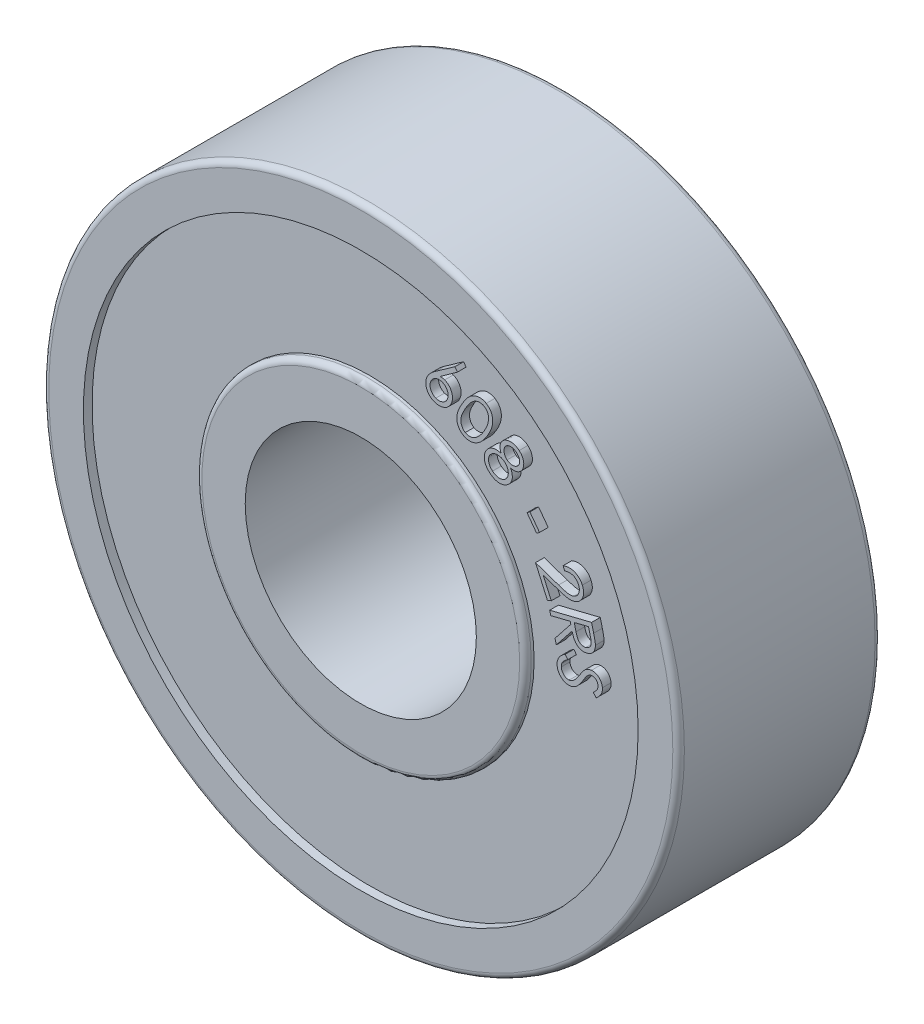
from build123d import *

# Parameters (mm, degrees)
SKETCH1_R           = 11
SKETCH1_R_2         = 4
BOSS_EXTRUDE1_DEPTH = 3.5
SKETCH2_R           = 9.6
SKETCH2_R_2         = 5.7
CUT_EXTRUDE1_DEPTH  = 0.3
BOSS_EXTRUDE2_DEPTH = 0.3
BOSS_EXTRUDE3_DEPTH = 0.3
FILLET1_R           = 0.2


with BuildPart() as part:
    # Sketch1 → Boss-Extrude1 (new, symmetric)
    with BuildSketch(Plane.XY):
        Circle(SKETCH1_R)
        Circle(SKETCH1_R_2, mode=Mode.SUBTRACT)
    extrude(amount=BOSS_EXTRUDE1_DEPTH, both=True)

    # Sketch2 → Cut-Extrude1 (cut)
    with BuildSketch(Plane.XY.offset(3.5)):
        Circle(SKETCH2_R)
        Circle(SKETCH2_R_2, mode=Mode.SUBTRACT)
    cut_extrude1 = extrude(amount=-CUT_EXTRUDE1_DEPTH, mode=Mode.SUBTRACT)

    # Mirror1: Cut-Extrude1 across plane
    add(cut_extrude1.mirror(Plane.XY), mode=Mode.SUBTRACT)

    # Sketch3 → Boss-Extrude2 (add)
    # profile 1 of 7: a face of its own
    with BuildSketch(Plane.XY.offset(3.2)):
        with BuildLine():
            Line((7.076977021, 1.026831682), (7.16261404, 0.905737932))
            add(Edge.make_bspline(
                [(7.16261404, 0.905737932), (7.143953551, 0.893236863), (7.108205969, 0.869288779), (7.06056557, 0.829882985), (7.020757414, 0.789733593), (6.988448077, 0.749115551), (6.963811614, 0.707551881), (6.947375688, 0.665037829), (6.938276612, 0.621569567), (6.938996525, 0.592474821), (6.939356828, 0.577913412)],
                knots=[0, 0, 0, 0, 1.293605249, 2.478137558, 3.555540967, 4.546146378, 5.461755128, 6.327764464, 7.163075533, 8, 8, 8, 8], degree=3))
            add(Edge.make_bspline(
                [(6.939356828, 0.577913412), (6.940739081, 0.565537488), (6.943468719, 0.541097811), (6.953161388, 0.505519096), (6.966666925, 0.471388616), (6.984370047, 0.439131725), (7.005303137, 0.409523368), (7.029721084, 0.384102636), (7.05633468, 0.362287286), (7.085768413, 0.345340342), (7.116782497, 0.332744465), (7.148571924, 0.324284886), (7.181020382, 0.319723973), (7.202767462, 0.320574799), (7.213695771, 0.321002355)],
                knots=[0, 0, 0, 0, 1.071200614, 2.115381178, 3.164681001, 4.22635561, 5.277356312, 6.278081387, 7.253536206, 8.231581676, 9.191190646, 10.128673544, 11.059623935, 12, 12, 12, 12], degree=3))
            add(Edge.make_bspline(
                [(7.213695771, 0.321002355), (7.226110859, 0.322572733), (7.25125408, 0.325753088), (7.28775569, 0.338706334), (7.323689363, 0.357136933), (7.345451164, 0.373911197), (7.356724617, 0.382600912)],
                knots=[0, 0, 0, 0, 0.947386718, 1.91866177, 2.921786489, 4, 4, 4, 4], degree=3))
            add(Edge.make_bspline(
                [(7.356724617, 0.382600912), (7.364813583, 0.389628685), (7.381832937, 0.404415264), (7.406956027, 0.429363903), (7.432849794, 0.458199259), (7.459816051, 0.490572468), (7.487667914, 0.526803949), (7.516961695, 0.56634168), (7.546528646, 0.610100438), (7.566404822, 0.640584944), (7.57667654, 0.656338893)],
                knots=[0, 0, 0, 0, 0.729652175, 1.535203374, 2.4093488, 3.368354771, 4.403997434, 5.521422745, 6.719107374, 8, 8, 8, 8], degree=3))
            add(Edge.make_bspline(
                [(7.57667654, 0.656338893), (7.586845788, 0.671994712), (7.606366936, 0.70204802), (7.634971739, 0.744455536), (7.661656964, 0.782221464), (7.685719931, 0.815594219), (7.708162319, 0.844198234), (7.727922923, 0.868580558), (7.746078344, 0.888083558), (7.75790782, 0.89898764), (7.763275098, 0.903935047)],
                knots=[0, 0, 0, 0, 1.44178108, 2.767679677, 3.950188744, 5.013127915, 5.944629057, 6.757769485, 7.436374313, 8, 8, 8, 8], degree=3))
            add(Edge.make_bspline(
                [(7.763275098, 0.903935047), (7.771591794, 0.910868396), (7.787977993, 0.924529017), (7.813968845, 0.942686052), (7.840832275, 0.958172569), (7.868075058, 0.972086454), (7.896578693, 0.982321616), (7.925425761, 0.990880251), (7.955077005, 0.997027612), (7.975189748, 0.999062782), (7.985330386, 1.000088893)],
                knots=[0, 0, 0, 0, 1.054938174, 2.078520909, 3.084687878, 4.075635399, 5.054733393, 6.030858732, 7.007179276, 8, 8, 8, 8], degree=3))
            add(Edge.make_bspline(
                [(7.985330386, 1.000088893), (8.001267523, 1.00072951), (8.032744484, 1.001994772), (8.079211889, 0.996231088), (8.124081582, 0.98521497), (8.166615863, 0.967586564), (8.206692348, 0.944913266), (8.242976732, 0.916638591), (8.275596042, 0.883535215), (8.303538509, 0.845444786), (8.326841926, 0.803821237), (8.345191599, 0.759648622), (8.35735167, 0.712884477), (8.360923889, 0.680741446), (8.362734232, 0.664451874)],
                knots=[0, 0, 0, 0, 1.017889249, 2.010402424, 2.980745164, 3.962632264, 4.943203903, 5.915044624, 6.892791457, 7.904219134, 8.924520923, 9.934955524, 10.95346856, 12, 12, 12, 12], degree=3))
            add(Edge.make_bspline(
                [(8.362734232, 0.664451874), (8.363393546, 0.64711594), (8.364705164, 0.612628356), (8.358517316, 0.561201148), (8.345193942, 0.51117226), (8.329398855, 0.470421111), (8.312505222, 0.438240125), (8.296867942, 0.413551552), (8.278710356, 0.388172359), (8.257904945, 0.362238911), (8.234177612, 0.336008695), (8.207794176, 0.30906866), (8.178845143, 0.281584261), (8.158173733, 0.263536203), (8.147590001, 0.254295624)],
                knots=[0, 0, 0, 0, 1.291665064, 2.569599581, 3.842596004, 5.143012825, 5.817581684, 6.548808337, 7.319484446, 8.142651535, 9.025540372, 9.954721754, 10.952820519, 12, 12, 12, 12], degree=3))
            Line((8.147590001, 0.254295624), (8.046327982, 0.369079278))
            add(Edge.make_bspline(
                [(8.046327982, 0.369079278), (8.054808236, 0.376518886), (8.071224301, 0.390920471), (8.093851206, 0.412898017), (8.114490779, 0.433553619), (8.132398373, 0.453506915), (8.14861815, 0.47203786), (8.162014547, 0.490021174), (8.17328618, 0.506954805), (8.185339631, 0.528004863), (8.196219668, 0.554807158), (8.205567479, 0.58750672), (8.209437103, 0.621499028), (8.208674086, 0.644216578), (8.208287117, 0.655737932)],
                knots=[0, 0, 0, 0, 1.182968606, 2.289989326, 3.307674873, 4.244684074, 5.10153492, 5.889410666, 6.594499546, 7.234271039, 8.430228475, 9.617852257, 10.791878183, 12, 12, 12, 12], degree=3))
            add(Edge.make_bspline(
                [(8.208287117, 0.655737932), (8.206639582, 0.6701768), (8.203461531, 0.698028992), (8.189722729, 0.736909497), (8.170123736, 0.771483686), (8.143419504, 0.800105933), (8.112644102, 0.82298413), (8.078518102, 0.839151649), (8.04142404, 0.847585469), (8.016015895, 0.84689522), (8.003058751, 0.84654322)],
                knots=[0, 0, 0, 0, 1.110394153, 2.141920708, 3.135757366, 4.13523793, 5.117629558, 6.05836752, 7.009844671, 8, 8, 8, 8], degree=3))
            add(Edge.make_bspline(
                [(8.003058751, 0.84654322), (7.995026578, 0.845576852), (7.979032128, 0.843652524), (7.955235638, 0.838316428), (7.932332641, 0.829698112), (7.90949921, 0.81911702), (7.886740517, 0.804880862), (7.863749665, 0.786360951), (7.839938307, 0.763736571), (7.824738694, 0.746510417), (7.816760675, 0.737468701)],
                knots=[0, 0, 0, 0, 0.873906778, 1.740208662, 2.626887475, 3.51277343, 4.455717877, 5.51881187, 6.697666299, 8, 8, 8, 8], degree=3))
            add(Edge.make_bspline(
                [(7.816760675, 0.737468701), (7.814144598, 0.734072382), (7.807897629, 0.725962258), (7.797344404, 0.71152694), (7.784614273, 0.692492833), (7.768831067, 0.669428131), (7.750915572, 0.641640422), (7.730201359, 0.609641867), (7.70703736, 0.573135871), (7.690754526, 0.547367351), (7.68214529, 0.533742739)],
                knots=[0, 0, 0, 0, 0.421234646, 1.005872833, 1.756541361, 2.670954, 3.751907505, 5.004912659, 6.416404901, 8, 8, 8, 8], degree=3))
            add(Edge.make_bspline(
                [(7.68214529, 0.533742739), (7.671599929, 0.517270609), (7.651183712, 0.48537994), (7.620329367, 0.439763357), (7.589576935, 0.398563061), (7.560275242, 0.360608304), (7.531107076, 0.327070161), (7.502782677, 0.297150285), (7.475373632, 0.270825586), (7.439697443, 0.242162709), (7.395614314, 0.212228908), (7.340862925, 0.185535339), (7.285399061, 0.166838821), (7.247479071, 0.162226438), (7.228719809, 0.159944662)],
                knots=[0, 0, 0, 0, 1.15394133, 2.234074179, 3.248141619, 4.186759783, 5.062319707, 5.86904735, 6.617296673, 7.302091977, 8.56736697, 9.751360306, 10.887583529, 12, 12, 12, 12], degree=3))
            add(Edge.make_bspline(
                [(7.228719809, 0.159944662), (7.215399812, 0.159400368), (7.189032425, 0.15832292), (7.149817826, 0.160981639), (7.111673035, 0.168023285), (7.074513011, 0.178889988), (7.038366226, 0.193684711), (7.003230068, 0.212372732), (6.969623596, 0.235551471), (6.937081374, 0.261658139), (6.906889434, 0.290843894), (6.880151097, 0.322608377), (6.856386952, 0.355945173), (6.836912749, 0.391652709), (6.820871989, 0.429074386), (6.808537082, 0.468431471), (6.799656903, 0.5097804), (6.796852939, 0.538210436), (6.79542654, 0.552673028)],
                knots=[0, 0, 0, 0, 0.984918958, 1.94968061, 2.897938618, 3.84677448, 4.806409233, 5.780190585, 6.782267682, 7.819421653, 8.861321141, 9.880375071, 10.884774166, 11.882163574, 12.880541693, 13.889731705, 14.926489235, 16, 16, 16, 16], degree=3))
            add(Edge.make_bspline(
                [(6.79542654, 0.552673028), (6.794757698, 0.563886346), (6.793432368, 0.586105877), (6.79440608, 0.619264579), (6.797810279, 0.651765847), (6.803024584, 0.683783604), (6.811278969, 0.714959521), (6.821643433, 0.745520813), (6.833738608, 0.775651717), (6.849062745, 0.80497269), (6.866809983, 0.833979693), (6.887692934, 0.862537349), (6.911493638, 0.89093824), (6.938674141, 0.918654811), (6.968492131, 0.946649328), (7.001930338, 0.973621235), (7.038019591, 1.000967687), (7.063758258, 1.018055692), (7.076977021, 1.026831682)],
                knots=[0, 0, 0, 0, 0.925199492, 1.833310964, 2.729190912, 3.616477546, 4.503188332, 5.382649839, 6.274568056, 7.175148828, 8.105047403, 9.074003634, 10.08731401, 11.155334203, 12.270642315, 13.455154994, 14.693028539, 16, 16, 16, 16], degree=3))
        make_face()
    # profile 2 of 7: a face of its own
    with BuildSketch(Plane.XY.offset(3.2)):
        with BuildLine():
            Line((7.988249057, 2.436477879), (8.059763481, 2.14771586))
            add(Edge.make_bspline(
                [(8.059763481, 2.14771586), (8.064566506, 2.128407137), (8.073780818, 2.091364534), (8.085468727, 2.037955292), (8.096386616, 1.989498601), (8.104571978, 1.945536771), (8.111728491, 1.906438013), (8.11651398, 1.871946333), (8.119770695, 1.842285832), (8.120451336, 1.824004119), (8.120761077, 1.81568461)],
                knots=[0, 0, 0, 0, 1.412275468, 2.709364054, 3.880762931, 4.937697293, 5.883315439, 6.701766271, 7.409209202, 8, 8, 8, 8], degree=3))
            add(Edge.make_bspline(
                [(8.120761077, 1.81568461), (8.120776205, 1.804455954), (8.120805995, 1.782345383), (8.117122538, 1.749642538), (8.112002537, 1.717824468), (8.103880788, 1.687012638), (8.092733809, 1.657460157), (8.080091017, 1.62848464), (8.064205203, 1.600792231), (8.046264648, 1.57415575), (8.026330681, 1.548883112), (8.0038731, 1.525950847), (7.979450999, 1.505102958), (7.952912844, 1.486540832), (7.924590709, 1.469808257), (7.894006475, 1.455787629), (7.861485991, 1.443622059), (7.838767125, 1.437495917), (7.827191365, 1.434374514)],
                knots=[0, 0, 0, 0, 1.030695119, 2.029562332, 3.018848375, 3.989691521, 4.950321672, 5.918195338, 6.890563358, 7.878179212, 8.866823208, 9.842841206, 10.821890458, 11.812373873, 12.814456695, 13.839468472, 14.899161852, 16, 16, 16, 16], degree=3))
            add(Edge.make_bspline(
                [(7.827191365, 1.434374514), (7.807842429, 1.430242147), (7.770031648, 1.42216687), (7.713008492, 1.419161347), (7.657914739, 1.424442269), (7.60493808, 1.436817214), (7.554914707, 1.4574124), (7.50889861, 1.485783547), (7.466570201, 1.521074498), (7.435214739, 1.556388671), (7.412079066, 1.588533261), (7.395751148, 1.616043569), (7.379662863, 1.64611605), (7.364863908, 1.679274569), (7.35034608, 1.714990652), (7.336934555, 1.753663381), (7.323933649, 1.795004828), (7.316356122, 1.823763823), (7.312467807, 1.838521148)],
                knots=[0, 0, 0, 0, 1.275058133, 2.491658637, 3.66645437, 4.835727489, 5.988980319, 7.140493755, 8.310427396, 9.53238789, 10.176174421, 10.863292094, 11.594657208, 12.375481033, 13.204677601, 14.081459806, 15.015524659, 16, 16, 16, 16], degree=3))
            Line((7.312467807, 1.838521148), (6.767395692, 1.150119706))
            Line((6.767395692, 1.150119706), (6.722924538, 1.329506725))
            Line((6.722924538, 1.329506725), (7.268297134, 2.016706244))
            Line((7.268297134, 2.016706244), (7.247864442, 2.099638937))
            Line((7.247864442, 2.099638937), (6.573585596, 1.93287211))
            Line((6.573585596, 1.93287211), (6.537828384, 2.077703841))
            Line((6.537828384, 2.077703841), (7.988249057, 2.436477879))
        make_face()
        with BuildLine():
            Line((7.881878865, 2.256489898), (7.389090404, 2.134494706))
            Line((7.389090404, 2.134494706), (7.448886077, 1.884795187))
            add(Edge.make_bspline(
                [(7.448886077, 1.884795187), (7.45182527, 1.873158867), (7.457520768, 1.85061029), (7.466838888, 1.818246483), (7.476313313, 1.788288956), (7.486726516, 1.761214146), (7.496340237, 1.73629989), (7.507002503, 1.714323086), (7.517754957, 1.6947112), (7.532255082, 1.672175304), (7.552615295, 1.648055162), (7.579700381, 1.623195142), (7.610547944, 1.60386531), (7.643996391, 1.589418931), (7.679367087, 1.58013706), (7.715812573, 1.576210425), (7.752898708, 1.577633305), (7.777261552, 1.582662429), (7.789631269, 1.58521586)],
                knots=[0, 0, 0, 0, 1.113104627, 2.156947082, 3.123516869, 4.025994073, 4.847154809, 5.599249428, 6.289533952, 6.920849126, 8.081774125, 9.206640824, 10.317455789, 11.440940587, 12.574367923, 13.695699714, 14.830040429, 16, 16, 16, 16], degree=3))
            add(Edge.make_bspline(
                [(7.789631269, 1.58521586), (7.801466822, 1.588694436), (7.824748285, 1.595537069), (7.857407395, 1.61139247), (7.886733034, 1.632194925), (7.913064883, 1.656700921), (7.935729281, 1.684464794), (7.953040426, 1.715077862), (7.966255238, 1.747389364), (7.971981167, 1.776400765), (7.974560954, 1.801413296), (7.974215186, 1.822815659), (7.973109763, 1.846583651), (7.970321076, 1.872755814), (7.965921922, 1.901369873), (7.960758064, 1.932518189), (7.953232016, 1.965981516), (7.947804353, 1.989067449), (7.944979827, 2.001081244)],
                knots=[0, 0, 0, 0, 1.167139315, 2.295854676, 3.419774794, 4.560981809, 5.694511835, 6.79953169, 7.881294031, 8.986598963, 9.587027662, 10.260653181, 11.01114033, 11.840973709, 12.752038354, 13.753427265, 14.830895641, 16, 16, 16, 16], degree=3))
            Line((7.944979827, 2.001081244), (7.881878865, 2.256489898))
        make_face(mode=Mode.SUBTRACT)
    # profile 3 of 7: a face of its own
    with BuildSketch(Plane.XY.offset(3.2)):
        with BuildLine():
            Line((7.060414561, 3.511869289), (7.002121291, 3.642878905))
            add(Edge.make_bspline(
                [(7.002121291, 3.642878905), (7.019046748, 3.649389983), (7.052264502, 3.662168569), (7.102995457, 3.675884268), (7.15312825, 3.685189402), (7.202773241, 3.689013412), (7.251884723, 3.688168907), (7.300394616, 3.682404913), (7.348464968, 3.671920608), (7.395349292, 3.65618022), (7.44047839, 3.636600891), (7.482783144, 3.612959308), (7.522128502, 3.586041097), (7.557704328, 3.554681531), (7.590405951, 3.519949692), (7.619870525, 3.481439778), (7.645898532, 3.439065729), (7.660342449, 3.40884503), (7.667686195, 3.393479866)],
                knots=[0, 0, 0, 0, 1.098894236, 2.156680244, 3.181097666, 4.186217298, 5.170181954, 6.154689921, 7.14338444, 8.14775162, 9.148513895, 10.121757056, 11.081953369, 12.033139171, 12.991201477, 13.970187426, 14.967978787, 16, 16, 16, 16], degree=3))
            add(Edge.make_bspline(
                [(7.667686195, 3.393479866), (7.674187468, 3.377963146), (7.686913275, 3.347590201), (7.700739558, 3.30097043), (7.709843388, 3.254994719), (7.714160962, 3.20948296), (7.71357306, 3.16455023), (7.708131969, 3.120119203), (7.697846931, 3.076294825), (7.682780741, 3.033603885), (7.66396494, 2.992720057), (7.641997692, 2.954359041), (7.616965657, 2.919015209), (7.588887409, 2.886705424), (7.557908414, 2.857471081), (7.52379419, 2.831456311), (7.486939528, 2.808063438), (7.460303398, 2.79554429), (7.44683283, 2.789213039)],
                knots=[0, 0, 0, 0, 1.123118816, 2.198430154, 3.241560922, 4.249489758, 5.246456332, 6.237297923, 7.233725572, 8.247256701, 9.256117715, 10.236171318, 11.195918377, 12.144405917, 13.091003849, 14.035755774, 15.006631783, 16, 16, 16, 16], degree=3))
            add(Edge.make_bspline(
                [(7.44683283, 2.789213039), (7.427378747, 2.781362952), (7.388815176, 2.765801827), (7.328041872, 2.752027308), (7.266232349, 2.74509101), (7.21338116, 2.746502857), (7.168982396, 2.751905851), (7.131809362, 2.757993974), (7.090749349, 2.766016142), (7.046215934, 2.7771954), (6.997664279, 2.789510805), (6.945726546, 2.805202187), (6.889887114, 2.822482014), (6.851557914, 2.835216014), (6.831748695, 2.841797174)],
                knots=[0, 0, 0, 0, 1.190553923, 2.360019362, 3.527973818, 4.717996915, 5.354156506, 6.06911908, 6.858375339, 7.730926837, 8.678051452, 9.704712043, 10.813753963, 12, 12, 12, 12], degree=3))
            Line((6.831748695, 2.841797174), (6.313118888, 3.018479866))
            Line((6.313118888, 3.018479866), (6.594068407, 2.387470251))
            Line((6.594068407, 2.387470251), (6.462157349, 2.328876501))
            Line((6.462157349, 2.328876501), (6.048695811, 3.257362078))
            Line((6.048695811, 3.257362078), (6.845570811, 2.986328424))
            add(Edge.make_bspline(
                [(6.845570811, 2.986328424), (6.864880324, 2.979654683), (6.902002582, 2.966824514), (6.955788187, 2.949361597), (7.005326416, 2.934404588), (7.050483325, 2.921413436), (7.091296525, 2.91042929), (7.128008155, 2.902063834), (7.160335526, 2.89556277), (7.197451731, 2.89030818), (7.240572937, 2.888099792), (7.290432039, 2.892455892), (7.338939171, 2.902657183), (7.36935841, 2.91495087), (7.384633311, 2.921124097)],
                knots=[0, 0, 0, 0, 1.320807282, 2.539232813, 3.655652852, 4.666085234, 5.577070877, 6.38760905, 7.100050351, 7.708117777, 8.810154231, 9.882434552, 10.936672848, 12, 12, 12, 12], degree=3))
            add(Edge.make_bspline(
                [(7.384633311, 2.921124097), (7.393953216, 2.925535007), (7.412397621, 2.934264345), (7.437910988, 2.950628617), (7.461337911, 2.96917867), (7.482661533, 2.989848178), (7.501726104, 3.012807907), (7.518297817, 3.038123543), (7.533152326, 3.065449711), (7.545264251, 3.095012381), (7.554734935, 3.125595847), (7.561599178, 3.156528363), (7.564794112, 3.18756892), (7.565118837, 3.218655373), (7.56242574, 3.249874575), (7.556402541, 3.281091867), (7.546959071, 3.312338451), (7.53855548, 3.332648452), (7.534272734, 3.342999097)],
                knots=[0, 0, 0, 0, 0.993184646, 1.965545697, 2.914075148, 3.870045696, 4.823232639, 5.784649248, 6.782609973, 7.817265863, 8.858702921, 9.866240421, 10.866440821, 11.861032577, 12.859366931, 13.881967814, 14.920581025, 16, 16, 16, 16], degree=3))
            add(Edge.make_bspline(
                [(7.534272734, 3.342999097), (7.529263059, 3.353619747), (7.519435674, 3.374454077), (7.501556311, 3.403418667), (7.481572872, 3.429719323), (7.459659157, 3.453731432), (7.435089897, 3.474624827), (7.408866855, 3.493609022), (7.38021358, 3.509359536), (7.349799812, 3.522749246), (7.317713831, 3.532740249), (7.284388743, 3.540289181), (7.249798603, 3.5435502), (7.214004715, 3.544364892), (7.177100395, 3.541160915), (7.139045706, 3.534751997), (7.099850724, 3.525158857), (7.073776739, 3.516372201), (7.060414561, 3.511869289)],
                knots=[0, 0, 0, 0, 1.005912945, 1.973280471, 2.910778015, 3.834215764, 4.753293405, 5.670444424, 6.604358083, 7.550152227, 8.514008703, 9.480575917, 10.473212795, 11.486389798, 12.545830462, 13.642462933, 14.791829109, 16, 16, 16, 16], degree=3))
        make_face()
    # profile 4 of 7: a face of its own
    with BuildSketch(Plane.XY.offset(3.2)):
        Polygon((5.853954604, 4.681016256), (6.186286334, 4.231797506), (6.0868272, 4.158179718), (5.754495469, 4.607398468), align=None)
    # profile 5 of 7: a face of its own
    with BuildSketch(Plane.XY.offset(3.2)):
        with BuildLine():
            add(Edge.make_bspline(
                [(5.189386212, 5.6587177), (5.194586927, 5.646134291), (5.204749684, 5.621544959), (5.218070193, 5.584945038), (5.228712419, 5.549444832), (5.236378648, 5.515054238), (5.242378055, 5.482013139), (5.245308617, 5.450047942), (5.246005431, 5.419310243), (5.243603874, 5.380256122), (5.235024486, 5.33306466), (5.216198575, 5.279043079), (5.188843372, 5.227753223), (5.164922557, 5.196954938), (5.152727558, 5.181253758)],
                knots=[0, 0, 0, 0, 0.96444767, 1.884634333, 2.757917164, 3.587536687, 4.379562593, 5.13499021, 5.858836879, 6.555465729, 7.904015149, 9.241375117, 10.59363378, 12, 12, 12, 12], degree=3))
            add(Edge.make_bspline(
                [(5.152727558, 5.181253758), (5.143384508, 5.170771055), (5.124886846, 5.150017072), (5.094391988, 5.122081969), (5.06213001, 5.097158661), (5.027717717, 5.075988402), (4.991794542, 5.057345221), (4.953720021, 5.042352678), (4.91375897, 5.030611085), (4.886251485, 5.025285628), (4.872379, 5.022599912)],
                knots=[0, 0, 0, 0, 1.023323555, 2.026007946, 3.010521934, 3.991345134, 4.967944915, 5.957942348, 6.970156161, 8, 8, 8, 8], degree=3))
            add(Edge.make_bspline(
                [(4.872379, 5.022599912), (4.855081808, 5.02034445), (4.820776574, 5.015871231), (4.768971456, 5.01716734), (4.717633914, 5.024036589), (4.666684702, 5.037370524), (4.616291267, 5.057161873), (4.566396204, 5.08298636), (4.51692892, 5.114955513), (4.485546003, 5.14009974), (4.469434289, 5.153008565)],
                knots=[0, 0, 0, 0, 0.955510816, 1.895048748, 2.83201348, 3.791369806, 4.775830962, 5.795468925, 6.868213127, 8, 8, 8, 8], degree=3))
            add(Edge.make_bspline(
                [(4.469434289, 5.153008565), (4.454479521, 5.16618626), (4.425428449, 5.191785198), (4.38685707, 5.233165853), (4.35384453, 5.275311061), (4.32641646, 5.318497311), (4.305147872, 5.362863861), (4.288717111, 5.407948847), (4.278949315, 5.454285346), (4.274509417, 5.50096265), (4.275027634, 5.547130442), (4.278920555, 5.591819394), (4.28588695, 5.634753577), (4.297258447, 5.675629763), (4.311844388, 5.714750652), (4.330398062, 5.751916476), (4.352274696, 5.78737118), (4.369644338, 5.809124667), (4.378388615, 5.820075873)],
                knots=[0, 0, 0, 0, 1.268493105, 2.464169686, 3.595675489, 4.673202029, 5.714274908, 6.722806186, 7.720960851, 8.720398139, 9.702513272, 10.65633128, 11.574741911, 12.467418361, 13.353395327, 14.228959945, 15.108417628, 16, 16, 16, 16], degree=3))
            add(Edge.make_bspline(
                [(4.378388615, 5.820075873), (4.385081075, 5.827797463), (4.398317958, 5.843069842), (4.420057342, 5.863860192), (4.443106621, 5.88240479), (4.466730909, 5.899754668), (4.491730894, 5.91471382), (4.517767852, 5.927724759), (4.54489526, 5.938837935), (4.573261932, 5.948257679), (4.603090441, 5.955503895), (4.634456783, 5.960262193), (4.667508718, 5.962661604), (4.702137705, 5.962500408), (4.738563332, 5.960419006), (4.776582145, 5.955853476), (4.816274077, 5.948899516), (4.843056985, 5.942791111), (4.856754, 5.939667219)],
                knots=[0, 0, 0, 0, 0.937079849, 1.853431831, 2.754686371, 3.64983064, 4.540198755, 5.423712657, 6.317865965, 7.227373881, 8.163416963, 9.130297834, 10.134573654, 11.200477229, 12.305010558, 13.480102711, 14.711302252, 16, 16, 16, 16], degree=3))
            add(Edge.make_bspline(
                [(4.856754, 5.939667219), (4.849687556, 5.95814913), (4.836046158, 5.993827485), (4.82358244, 6.048280503), (4.818598542, 6.100938297), (4.820959731, 6.151721294), (4.830177268, 6.199924549), (4.84614947, 6.244922106), (4.867594369, 6.287113351), (4.886973834, 6.311846588), (4.896717942, 6.324282604)],
                knots=[0, 0, 0, 0, 1.163667917, 2.246399591, 3.276647655, 4.268313377, 5.229231514, 6.154147613, 7.07189459, 8, 8, 8, 8], degree=3))
            add(Edge.make_bspline(
                [(4.896717942, 6.324282604), (4.907683413, 6.336181438), (4.929626159, 6.359991916), (4.969424139, 6.389242169), (5.013794355, 6.413779497), (5.063010445, 6.432366377), (5.115105637, 6.445474527), (5.169137572, 6.450758711), (5.224123547, 6.449006456), (5.279443767, 6.439378345), (5.334103699, 6.423764691), (5.386624442, 6.401167554), (5.436588972, 6.372460307), (5.466812831, 6.348423436), (5.482054481, 6.336301835)],
                knots=[0, 0, 0, 0, 0.896649129, 1.794263584, 2.727688517, 3.704743748, 4.706942521, 5.701924564, 6.70909515, 7.752303184, 8.811867495, 9.858316991, 10.919966387, 12, 12, 12, 12], degree=3))
            add(Edge.make_bspline(
                [(5.482054481, 6.336301835), (5.496249425, 6.323543638), (5.524228154, 6.298396788), (5.55941752, 6.254658095), (5.589349943, 6.207855692), (5.612382396, 6.157469722), (5.629852896, 6.105468745), (5.639324054, 6.05243939), (5.642381776, 5.999181913), (5.637178257, 5.946408746), (5.6265171, 5.895173466), (5.608669998, 5.847198845), (5.585526413, 5.802428989), (5.56501446, 5.776122127), (5.554770827, 5.762984527)],
                knots=[0, 0, 0, 0, 1.070324559, 2.109646873, 3.141191903, 4.183098806, 5.213047539, 6.213764385, 7.199460029, 8.199164548, 9.183318134, 10.130076543, 11.066163551, 12, 12, 12, 12], degree=3))
            add(Edge.make_bspline(
                [(5.554770827, 5.762984527), (5.54379117, 5.750913532), (5.522131412, 5.727100871), (5.484194065, 5.697919216), (5.443016021, 5.674940222), (5.398496987, 5.658618015), (5.350659691, 5.649184159), (5.299689207, 5.645548973), (5.245326512, 5.648772373), (5.208462643, 5.655326203), (5.189386212, 5.6587177)],
                knots=[0, 0, 0, 0, 0.97532477, 1.924039999, 2.850048428, 3.789069322, 4.74981637, 5.759732031, 6.840699013, 8, 8, 8, 8], degree=3))
        make_face()
        with BuildLine():
            add(Edge.make_bspline(
                [(5.38409775, 6.230833085), (5.376379768, 6.237066801), (5.361182052, 6.249341806), (5.33710676, 6.265345425), (5.312356486, 6.278470878), (5.287483659, 6.289588881), (5.261856356, 6.297212228), (5.236003056, 6.303159158), (5.209497651, 6.306105023), (5.1829331, 6.306359877), (5.156899074, 6.304244254), (5.131945573, 6.300100204), (5.108243046, 6.293800963), (5.085926193, 6.285107914), (5.064985942, 6.273841909), (5.045476685, 6.260289737), (5.027245884, 6.244559564), (5.016392875, 6.232652172), (5.010900635, 6.226626354)],
                knots=[0, 0, 0, 0, 1.146485111, 2.25757925, 3.335045229, 4.382545061, 5.400645308, 6.420390147, 7.445837605, 8.476370927, 9.486937909, 10.461511295, 11.396776717, 12.317014496, 13.223529209, 14.13887382, 15.058164215, 16, 16, 16, 16], degree=3))
            add(Edge.make_bspline(
                [(5.010900635, 6.226626354), (5.005839109, 6.220224564), (4.99578683, 6.207510497), (4.983426128, 6.186494599), (4.973480349, 6.164339704), (4.966242115, 6.140687871), (4.961202053, 6.115942493), (4.958361054, 6.089776104), (4.958689929, 6.062428016), (4.960509576, 6.034150041), (4.965471075, 6.005950435), (4.972180325, 5.97851801), (4.981620808, 5.952617748), (4.993066388, 5.928009891), (5.006998383, 5.90477971), (5.023224391, 5.882778296), (5.041979743, 5.862262831), (5.055863823, 5.8498098), (5.062883808, 5.843513373)],
                knots=[0, 0, 0, 0, 0.918151234, 1.823464464, 2.737379604, 3.647108851, 4.60273986, 5.57807124, 6.604502568, 7.678956734, 8.765597248, 9.824305897, 10.855436574, 11.864617828, 12.876317318, 13.900515113, 14.938471084, 16, 16, 16, 16], degree=3))
            add(Edge.make_bspline(
                [(5.062883808, 5.843513373), (5.072382931, 5.835879565), (5.091268033, 5.820702875), (5.123398517, 5.803691573), (5.156881454, 5.789329176), (5.192577408, 5.780318195), (5.228880735, 5.775453144), (5.265198578, 5.775295787), (5.300730245, 5.780612822), (5.335287657, 5.790132952), (5.367520416, 5.803920679), (5.397136709, 5.820358669), (5.422986409, 5.840337391), (5.437576847, 5.855931193), (5.444794865, 5.863645585)],
                knots=[0, 0, 0, 0, 1.03473016, 2.057135568, 3.081244867, 4.129368344, 5.178115435, 6.192388268, 7.208521628, 8.225941052, 9.234323582, 10.184738541, 11.101974057, 12, 12, 12, 12], degree=3))
            add(Edge.make_bspline(
                [(5.444794865, 5.863645585), (5.449452204, 5.869450313), (5.458727382, 5.881010537), (5.469933396, 5.900173274), (5.479869867, 5.919987059), (5.48692058, 5.941301889), (5.492320197, 5.963609566), (5.496088768, 5.987015195), (5.496990346, 6.011574277), (5.496657021, 6.036918064), (5.493345511, 6.062740128), (5.487035173, 6.088363184), (5.477536944, 6.11350743), (5.465231668, 6.138289138), (5.449425244, 6.162344555), (5.43056933, 6.185829689), (5.408981013, 6.209173644), (5.392554652, 6.223471841), (5.38409775, 6.230833085)],
                knots=[0, 0, 0, 0, 0.858330494, 1.709381231, 2.557833814, 3.413822764, 4.294771091, 5.207644886, 6.145747529, 7.129250216, 8.132152716, 9.144946077, 10.169821944, 11.230308818, 12.334012682, 13.486582712, 14.705999292, 16, 16, 16, 16], degree=3))
        make_face(mode=Mode.SUBTRACT)
        with BuildLine():
            add(Edge.make_bspline(
                [(4.97784775, 5.739547027), (4.968072788, 5.747448585), (4.948936795, 5.762917101), (4.918274536, 5.782554535), (4.886833683, 5.798776336), (4.85473779, 5.812354609), (4.821419708, 5.821390433), (4.787585194, 5.827885912), (4.752845051, 5.830950849), (4.717744872, 5.830139612), (4.683127079, 5.826735311), (4.649883795, 5.819964745), (4.61826248, 5.810884891), (4.588648529, 5.798350704), (4.560743994, 5.783335654), (4.534786049, 5.76513744), (4.510593696, 5.744079755), (4.496218334, 5.728085402), (4.488965539, 5.720015777)],
                knots=[0, 0, 0, 0, 1.109464336, 2.171947235, 3.2085584, 4.231988469, 5.242955981, 6.250977867, 7.272111531, 8.316094379, 9.347711258, 10.340046327, 11.308516214, 12.248239019, 13.174500274, 14.102112258, 15.042459394, 16, 16, 16, 16], degree=3))
            add(Edge.make_bspline(
                [(4.488965539, 5.720015777), (4.480602073, 5.709435387), (4.463914822, 5.688324806), (4.44516328, 5.652410092), (4.431161138, 5.614012787), (4.422214489, 5.573509222), (4.41881507, 5.531633302), (4.421658006, 5.489673484), (4.430051638, 5.447930207), (4.445016207, 5.407080512), (4.465582648, 5.367187791), (4.491966576, 5.328877959), (4.524060519, 5.292291), (4.548718967, 5.270148342), (4.561381404, 5.258777796)],
                knots=[0, 0, 0, 0, 0.928098739, 1.851794183, 2.778041455, 3.739749631, 4.702597536, 5.664454449, 6.630047031, 7.628273754, 8.65362301, 9.716647006, 10.827468267, 12, 12, 12, 12], degree=3))
            add(Edge.make_bspline(
                [(4.561381404, 5.258777796), (4.571664343, 5.2504855), (4.591748181, 5.23428963), (4.623466144, 5.213534245), (4.655395661, 5.196250326), (4.687687255, 5.182607397), (4.72030531, 5.172636208), (4.753324826, 5.166107742), (4.786709776, 5.163930204), (4.820127427, 5.164733793), (4.852785724, 5.169038041), (4.884273979, 5.175735909), (4.913899909, 5.185990793), (4.94222114, 5.198101638), (4.968821603, 5.213231451), (4.993597613, 5.231167382), (5.016946341, 5.251616746), (5.030884662, 5.2671412), (5.037943904, 5.275003758)],
                knots=[0, 0, 0, 0, 1.188993062, 2.322248911, 3.407802256, 4.454786609, 5.47337354, 6.47460047, 7.478383676, 8.479935574, 9.480105628, 10.44081974, 11.373519153, 12.298510898, 13.21141825, 14.122586178, 15.049159707, 16, 16, 16, 16], degree=3))
            add(Edge.make_bspline(
                [(5.037943904, 5.275003758), (5.044375471, 5.282961476), (5.057111248, 5.298719333), (5.072220048, 5.324949766), (5.085118906, 5.352079119), (5.094665961, 5.380751623), (5.101340116, 5.410752664), (5.104894013, 5.442172707), (5.105425356, 5.474963787), (5.103029282, 5.508648241), (5.097668263, 5.542222213), (5.089567603, 5.574943402), (5.07853539, 5.606212629), (5.064173023, 5.635931829), (5.0470663, 5.664284415), (5.026752056, 5.690994432), (5.003917568, 5.716545673), (4.986625361, 5.731802557), (4.97784775, 5.739547027)],
                knots=[0, 0, 0, 0, 0.945492101, 1.872261549, 2.792845489, 3.722022135, 4.662046284, 5.63242696, 6.64292728, 7.692955472, 8.753567252, 9.785437493, 10.808611807, 11.816046644, 12.835013809, 13.867591537, 14.917578817, 16, 16, 16, 16], degree=3))
        make_face(mode=Mode.SUBTRACT)
    # profile 6 of 7: a face of its own
    with BuildSketch(Plane.XY.offset(3.2)):
        with BuildLine():
            add(Edge.make_bspline(
                [(3.510655427, 6.757478069), (3.523044396, 6.777992727), (3.547066884, 6.81777111), (3.584172519, 6.874306453), (3.620442947, 6.926465684), (3.656489787, 6.974017044), (3.692126867, 7.01698291), (3.727361389, 7.055365327), (3.762077889, 7.089102521), (3.796741048, 7.118263828), (3.831222307, 7.143674947), (3.865751559, 7.165957527), (3.90045395, 7.185168264), (3.934981652, 7.202005651), (3.97007852, 7.215147169), (4.005221314, 7.225645679), (4.040506165, 7.233748063), (4.075949707, 7.238015399), (4.111199703, 7.239941823), (4.145938078, 7.238900778), (4.180159284, 7.235854638), (4.213619587, 7.229198753), (4.246739278, 7.220830734), (4.278976138, 7.208669758), (4.310937007, 7.194889796), (4.33126479, 7.183351274), (4.341484754, 7.177550184)],
                knots=[0, 0, 0, 0, 1.647452083, 3.194446495, 4.648165615, 6.014348364, 7.295380384, 8.484425794, 9.594739905, 10.620989546, 11.596064572, 12.537719104, 13.443964193, 14.321744571, 15.176037305, 16.016960352, 16.842260648, 17.661332608, 18.468038747, 19.267067421, 20.04884938, 20.826740038, 21.610067052, 22.394271269, 23.192706311, 24, 24, 24, 24], degree=3))
            add(Edge.make_bspline(
                [(4.341484754, 7.177550184), (4.35157638, 7.171156227), (4.371584661, 7.158479173), (4.400033348, 7.137569921), (4.425760206, 7.114119938), (4.450107403, 7.089544584), (4.471988621, 7.062686788), (4.491794391, 7.034108182), (4.509723707, 7.003854765), (4.525259913, 6.971780276), (4.538489923, 6.938019117), (4.549382861, 6.902797577), (4.557465292, 6.866009703), (4.562856515, 6.827737256), (4.565507553, 6.787972877), (4.565505103, 6.746813505), (4.562578299, 6.704199779), (4.557690709, 6.659992141), (4.549117067, 6.614016125), (4.536958299, 6.566188899), (4.521400098, 6.516260364), (4.501512669, 6.464617202), (4.478843451, 6.41071913), (4.451873025, 6.355067688), (4.421172748, 6.297465922), (4.398886775, 6.258718379), (4.387458312, 6.238848261)],
                knots=[0, 0, 0, 0, 0.815693431, 1.617244076, 2.406711903, 3.190202769, 3.977445694, 4.768570701, 5.562646356, 6.376272847, 7.199244939, 8.036444902, 8.891007748, 9.768257746, 10.673118776, 11.610079517, 12.576359211, 13.588411736, 14.645450033, 15.766754462, 16.95644851, 18.213974558, 19.543952273, 20.947990746, 22.434899919, 24, 24, 24, 24], degree=3))
            add(Edge.make_bspline(
                [(4.387458312, 6.238848261), (4.375658761, 6.219343172), (4.352628649, 6.181273556), (4.317015222, 6.12693388), (4.281094073, 6.076914483), (4.245482688, 6.03085953), (4.209716836, 5.989101968), (4.174163403, 5.951247704), (4.138599853, 5.917538667), (4.102583564, 5.888222522), (4.066523088, 5.862700694), (4.030905805, 5.839518437), (3.994689615, 5.820274298), (3.958931747, 5.802996011), (3.92260917, 5.789652272), (3.88645934, 5.778626546), (3.850015276, 5.771215034), (3.813779971, 5.766277694), (3.777697606, 5.764570654), (3.742237354, 5.765401052), (3.707378153, 5.769063793), (3.673201098, 5.775314714), (3.639645532, 5.784402646), (3.60681343, 5.796197118), (3.574503026, 5.810561928), (3.553836929, 5.822211912), (3.543407831, 5.82809105)],
                knots=[0, 0, 0, 0, 1.558036171, 3.040941719, 4.439181865, 5.766105195, 7.018758616, 8.195542268, 9.314262581, 10.365268165, 11.366397101, 12.333015677, 13.267287763, 14.167636221, 15.044996405, 15.909224775, 16.748361006, 17.583915235, 18.406439406, 19.214506741, 20.006050072, 20.7996039, 21.586753692, 22.379273342, 23.18210401, 24, 24, 24, 24], degree=3))
            add(Edge.make_bspline(
                [(3.543407831, 5.82809105), (3.533371112, 5.834222027), (3.513446744, 5.846392921), (3.4859508, 5.867634543), (3.460215189, 5.890275817), (3.436376068, 5.91449691), (3.415042137, 5.940946833), (3.395438201, 5.968727292), (3.378234839, 5.998576142), (3.362926718, 6.029946443), (3.350010977, 6.062988716), (3.339702901, 6.097450294), (3.332346395, 6.133267892), (3.327118607, 6.170393396), (3.324804356, 6.208965371), (3.325107403, 6.248921828), (3.328290826, 6.290138168), (3.333588674, 6.332935955), (3.342437557, 6.377731339), (3.355078035, 6.424811406), (3.371933678, 6.474224228), (3.391969843, 6.526246344), (3.416300618, 6.580616153), (3.44378607, 6.637675383), (3.475540167, 6.697017252), (3.498712776, 6.736915429), (3.510655427, 6.757478069)],
                knots=[0, 0, 0, 0, 0.809193552, 1.606368565, 2.388062977, 3.168296049, 3.942656184, 4.725080242, 5.506865897, 6.311817253, 7.126253287, 7.946594166, 8.785109086, 9.641356877, 10.525743148, 11.442912133, 12.390151821, 13.370352211, 14.410340417, 15.531053157, 16.723869266, 18.003186525, 19.367808404, 20.823527324, 22.362916106, 24, 24, 24, 24], degree=3))
        make_face()
        with BuildLine():
            add(Edge.make_bspline(
                [(3.630547254, 6.682958838), (3.620221449, 6.665392902), (3.600197137, 6.631328171), (3.572929949, 6.580873879), (3.548762085, 6.532984005), (3.527752928, 6.487670761), (3.509592396, 6.445062341), (3.494690308, 6.404998563), (3.48327332, 6.367437537), (3.474683849, 6.332232668), (3.468824287, 6.298800657), (3.46571246, 6.266653396), (3.463918864, 6.235458038), (3.46493127, 6.205223656), (3.467851261, 6.17598656), (3.473053152, 6.147772275), (3.480147422, 6.120497225), (3.492538125, 6.086133107), (3.511542662, 6.046330999), (3.541241334, 6.004751405), (3.575554847, 5.968808063), (3.602817938, 5.950907328), (3.616424658, 5.941973261)],
                knots=[0, 0, 0, 0, 1.47554823, 2.861456041, 4.152549281, 5.359823398, 6.478019408, 7.506149652, 8.453830721, 9.319422576, 10.129142106, 10.909376059, 11.657384493, 12.390328903, 13.097664623, 13.7834344, 14.466089735, 15.136024757, 16.427179125, 17.644803262, 18.824546301, 20, 20, 20, 20], degree=3))
            add(Edge.make_bspline(
                [(3.616424658, 5.941973261), (3.630918357, 5.934323454), (3.659826954, 5.919065431), (3.707720825, 5.905701424), (3.757986558, 5.900147741), (3.801413513, 5.901627178), (3.836656266, 5.907822604), (3.863650946, 5.914090585), (3.890256786, 5.923897556), (3.917102703, 5.935010136), (3.943602815, 5.949510015), (3.970169637, 5.965831061), (3.99667447, 5.984708597), (4.013647091, 5.998753811), (4.022374177, 6.005975665)],
                knots=[0, 0, 0, 0, 1.338007035, 2.668739434, 4.038183073, 5.465466408, 6.20521133, 6.964583444, 7.729288881, 8.522454135, 9.340140568, 10.197647248, 11.073255203, 12, 12, 12, 12], degree=3))
            add(Edge.make_bspline(
                [(4.022374177, 6.005975665), (4.03309713, 6.015376839), (4.054953289, 6.03453887), (4.086306835, 6.065965767), (4.117690502, 6.099557924), (4.148320767, 6.136006696), (4.178355036, 6.175206221), (4.208030466, 6.216891631), (4.237288919, 6.261196197), (4.255949618, 6.291969613), (4.265463119, 6.307658357)],
                knots=[0, 0, 0, 0, 0.879205792, 1.792049364, 2.736102679, 3.713611354, 4.72667386, 5.780746889, 6.868591834, 8, 8, 8, 8], degree=3))
            add(Edge.make_bspline(
                [(4.265463119, 6.307658357), (4.274701981, 6.323514803), (4.292784055, 6.354548652), (4.317165172, 6.40114321), (4.339658699, 6.445960019), (4.359325487, 6.48948444), (4.375664307, 6.531852093), (4.389941909, 6.572591521), (4.401881133, 6.611803542), (4.410380466, 6.649845295), (4.417219564, 6.686291851), (4.421429902, 6.721323751), (4.423246033, 6.754950805), (4.422978321, 6.787068772), (4.420697686, 6.817826855), (4.415913831, 6.847098643), (4.408669375, 6.874831814), (4.396336672, 6.909230621), (4.377074091, 6.948651577), (4.348216969, 6.990447515), (4.314216194, 7.026302644), (4.287086736, 7.044024882), (4.2735761, 7.052850665)],
                knots=[0, 0, 0, 0, 1.328710852, 2.600520349, 3.807127993, 4.959618234, 6.05731199, 7.094083991, 8.085413991, 9.023161106, 9.91513934, 10.769772044, 11.576009719, 12.352094753, 13.094153729, 13.807183223, 14.496772946, 15.166628375, 16.45111389, 17.660269213, 18.834799754, 20, 20, 20, 20], degree=3))
            add(Edge.make_bspline(
                [(4.2735761, 7.052850665), (4.259091849, 7.060534617), (4.230141022, 7.075893146), (4.181942627, 7.088762641), (4.131168922, 7.094220524), (4.087273895, 7.091925443), (4.051336593, 7.08670747), (4.024286388, 7.079553647), (3.997254181, 7.07048761), (3.97030279, 7.059101918), (3.943479975, 7.045236739), (3.917054607, 7.028802461), (3.890388513, 7.010491246), (3.863871328, 6.989215122), (3.83673365, 6.96498905), (3.809536022, 6.936587441), (3.781616888, 6.904273484), (3.752620278, 6.868084373), (3.723073149, 6.827597501), (3.692803039, 6.782981022), (3.661390378, 6.734643902), (3.641049542, 6.700557945), (3.630547254, 6.682958838)],
                knots=[0, 0, 0, 0, 1.18305455, 2.364665469, 3.581918313, 4.865940634, 5.533173231, 6.206361281, 6.886997529, 7.594978164, 8.321014114, 9.069243509, 9.845210403, 10.660099312, 11.527346371, 12.475480957, 13.502864451, 14.616541664, 15.829753734, 17.128255368, 18.517273796, 20, 20, 20, 20], degree=3))
        make_face(mode=Mode.SUBTRACT)
    # profile 7 of 7: a face of its own
    with BuildSketch(Plane.XY.offset(3.2)):
        with BuildLine():
            Line((3.259020931, 7.735829686), (3.345258912, 7.616839302))
            Line((3.345258912, 7.616839302), (2.750607469, 7.189555648))
            add(Edge.make_bspline(
                [(2.750607469, 7.189555648), (2.764549948, 7.188768772), (2.791636716, 7.187240067), (2.831031151, 7.181431645), (2.868006815, 7.172988132), (2.891298195, 7.164733108), (2.902650739, 7.160709494)],
                knots=[0, 0, 0, 0, 1.077632327, 2.093571702, 3.07078029, 4, 4, 4, 4], degree=3))
            add(Edge.make_bspline(
                [(2.902650739, 7.160709494), (2.916090094, 7.155155715), (2.942547261, 7.14422236), (2.979740198, 7.123606836), (3.013803711, 7.099758429), (3.045057297, 7.072903951), (3.073099721, 7.04254215), (3.098426575, 7.009227952), (3.120370067, 6.972559122), (3.139170476, 6.933431116), (3.154402733, 6.892603901), (3.165629764, 6.850862229), (3.172639004, 6.808794755), (3.174970551, 6.766292559), (3.1731812, 6.72351375), (3.166980992, 6.680292502), (3.157027941, 6.636604949), (3.146744742, 6.608132737), (3.14153295, 6.593702283)],
                knots=[0, 0, 0, 0, 1.01743847, 2.002963574, 2.969775988, 3.92430442, 4.881892947, 5.857993209, 6.848916855, 7.868214235, 8.893283992, 9.895138317, 10.889998981, 11.873301365, 12.869915045, 13.882412113, 14.926751651, 16, 16, 16, 16], degree=3))
            add(Edge.make_bspline(
                [(3.14153295, 6.593702283), (3.133298806, 6.574335332), (3.117104725, 6.536246378), (3.084853049, 6.483861036), (3.046740354, 6.437177334), (3.002987092, 6.396551772), (2.954531996, 6.362006323), (2.901390622, 6.334923003), (2.844493748, 6.314490982), (2.784294505, 6.302249653), (2.722630825, 6.296907064), (2.660946131, 6.300117528), (2.599828817, 6.31068591), (2.560658246, 6.324037353), (2.540871892, 6.330781609)],
                knots=[0, 0, 0, 0, 1.035414346, 2.036347976, 3.017971465, 3.995346073, 4.96856579, 5.939381811, 6.923988381, 7.937006642, 8.956729741, 9.964339931, 10.971720631, 12, 12, 12, 12], degree=3))
            add(Edge.make_bspline(
                [(2.540871892, 6.330781609), (2.522287916, 6.338587102), (2.485509036, 6.354034672), (2.435056302, 6.386012116), (2.389022735, 6.423405339), (2.348114208, 6.466610687), (2.313615302, 6.514980969), (2.285972887, 6.567293347), (2.265999597, 6.623366189), (2.25347095, 6.682273063), (2.248790901, 6.742584133), (2.251449944, 6.802742105), (2.261757997, 6.862050957), (2.274734783, 6.900033915), (2.281256508, 6.919122956)],
                knots=[0, 0, 0, 0, 1.011779335, 2.002376177, 2.990089552, 3.987407483, 4.98363171, 5.967873775, 6.952141598, 7.966361115, 8.986649343, 9.984640704, 10.987143757, 12, 12, 12, 12], degree=3))
            add(Edge.make_bspline(
                [(2.281256508, 6.919122956), (2.287196006, 6.933372691), (2.299315356, 6.962448804), (2.323005097, 7.004468213), (2.35156851, 7.045743389), (2.378765534, 7.079593784), (2.40315448, 7.106990071), (2.424358282, 7.127899417), (2.447491043, 7.14955572), (2.472765548, 7.171775577), (2.500150602, 7.194576688), (2.529553612, 7.218120977), (2.561487153, 7.241739954), (2.58361555, 7.257499193), (2.594958431, 7.265577283)],
                knots=[0, 0, 0, 0, 1.170658157, 2.388689085, 3.651449214, 4.976093974, 5.681115574, 6.433500391, 7.23470353, 8.085522527, 8.986623187, 9.938565816, 10.9433214, 12, 12, 12, 12], degree=3))
            Line((2.594958431, 7.265577283), (3.259020931, 7.735829686))
        make_face()
        with BuildLine():
            add(Edge.make_bspline(
                [(2.822722854, 7.051334494), (2.812664531, 7.054833155), (2.792892789, 7.061710508), (2.762483465, 7.068606462), (2.732204718, 7.072630955), (2.701979002, 7.073169245), (2.671899286, 7.070697555), (2.641842537, 7.065403415), (2.611936713, 7.056441356), (2.582423833, 7.044896947), (2.554237541, 7.030567209), (2.527754939, 7.014283762), (2.503542141, 6.995676167), (2.482048958, 6.974301089), (2.461814806, 6.95165556), (2.444859602, 6.926036282), (2.429612015, 6.898662354), (2.421494436, 6.879147873), (2.417374296, 6.869243148)],
                knots=[0, 0, 0, 0, 1.033665586, 2.031886465, 3.02254153, 3.99555741, 4.961789888, 5.950245301, 6.953808469, 7.988937912, 9.024387298, 10.020520243, 11.005138471, 11.982037111, 12.961258017, 13.948803449, 14.958899352, 16, 16, 16, 16], degree=3))
            add(Edge.make_bspline(
                [(2.417374296, 6.869243148), (2.413874694, 6.859184725), (2.406995493, 6.839412784), (2.400113007, 6.809004903), (2.396038381, 6.778720785), (2.395683638, 6.7485223), (2.397472358, 6.718358765), (2.403534979, 6.688459439), (2.411826718, 6.658391164), (2.423571351, 6.628966413), (2.43777961, 6.6006627), (2.454454025, 6.574347171), (2.473041731, 6.550179122), (2.493997511, 6.52844107), (2.516843717, 6.508774884), (2.542092862, 6.491575205), (2.569326584, 6.476475716), (2.58876049, 6.468512639), (2.5985642, 6.464495552)],
                knots=[0, 0, 0, 0, 1.035635808, 2.03575935, 3.028302658, 4.003173159, 4.970511056, 5.962623562, 6.965403228, 8.002505683, 9.039928692, 10.043134578, 11.029629541, 12.001621073, 12.97634539, 13.957723193, 14.969744393, 16, 16, 16, 16], degree=3))
            add(Edge.make_bspline(
                [(2.5985642, 6.464495552), (2.608614119, 6.460871166), (2.628340671, 6.453757017), (2.658809337, 6.446942044), (2.689081611, 6.442890391), (2.719305402, 6.442374366), (2.749300715, 6.444775889), (2.779179597, 6.450264967), (2.809109964, 6.458681998), (2.838543073, 6.470381622), (2.866839604, 6.48460719), (2.893174719, 6.501258467), (2.917330785, 6.519964404), (2.939369416, 6.540709953), (2.959018859, 6.56367882), (2.976235907, 6.588909673), (2.991330659, 6.616148383), (2.999294383, 6.635581608), (3.003311796, 6.645384975)],
                knots=[0, 0, 0, 0, 1.038736636, 2.038891379, 3.031465653, 4.006366568, 4.974470939, 5.955249925, 6.958060875, 7.995195687, 9.032651061, 10.035888245, 11.022413985, 12.00149633, 12.976251057, 13.957659478, 14.969712251, 16, 16, 16, 16], degree=3))
            add(Edge.make_bspline(
                [(3.003311796, 6.645384975), (3.006935823, 6.655535416), (3.014051353, 6.675465114), (3.020830439, 6.706041291), (3.024844836, 6.736403745), (3.025836149, 6.766724068), (3.023303051, 6.79691761), (3.017943665, 6.826958503), (3.009018473, 6.856770187), (2.997490443, 6.886295299), (2.983047901, 6.914508471), (2.966981078, 6.941236806), (2.948208279, 6.965324563), (2.927312203, 6.987113813), (2.904345762, 7.006715726), (2.879296711, 7.02430232), (2.851946923, 7.039334935), (2.832522022, 7.047310903), (2.822722854, 7.051334494)],
                knots=[0, 0, 0, 0, 1.045816322, 2.053388946, 3.034268365, 4.017123179, 4.992925423, 5.97168047, 6.975112883, 8.010107458, 9.045421935, 10.049702598, 11.03419254, 12.004208527, 12.976951746, 13.96187406, 14.971838357, 16, 16, 16, 16], degree=3))
        make_face(mode=Mode.SUBTRACT)
    extrude(amount=BOSS_EXTRUDE2_DEPTH)

    # Sketch4 → Boss-Extrude3 (add)
    # profile 1 of 7: a face of its own
    with BuildSketch(Plane(origin=(0, 0, -3.2), x_dir=(-1, 0, 0), z_dir=(0, 0, -1))):
        with BuildLine():
            Line((7.076977021, 1.026831682), (7.16261404, 0.905737932))
            add(Edge.make_bspline(
                [(7.16261404, 0.905737932), (7.143953551, 0.893236863), (7.108205969, 0.869288779), (7.06056557, 0.829882985), (7.020757414, 0.789733593), (6.988448077, 0.749115551), (6.963811614, 0.707551881), (6.947375688, 0.665037829), (6.938276612, 0.621569567), (6.938996525, 0.592474821), (6.939356828, 0.577913412)],
                knots=[0, 0, 0, 0, 1.293605249, 2.478137558, 3.555540967, 4.546146378, 5.461755128, 6.327764464, 7.163075533, 8, 8, 8, 8], degree=3))
            add(Edge.make_bspline(
                [(6.939356828, 0.577913412), (6.940739081, 0.565537488), (6.943468719, 0.541097811), (6.953161388, 0.505519096), (6.966666925, 0.471388616), (6.984370047, 0.439131725), (7.005303137, 0.409523368), (7.029721084, 0.384102636), (7.05633468, 0.362287286), (7.085768413, 0.345340342), (7.116782497, 0.332744465), (7.148571924, 0.324284886), (7.181020382, 0.319723973), (7.202767462, 0.320574799), (7.213695771, 0.321002355)],
                knots=[0, 0, 0, 0, 1.071200614, 2.115381178, 3.164681001, 4.22635561, 5.277356312, 6.278081387, 7.253536206, 8.231581676, 9.191190646, 10.128673544, 11.059623935, 12, 12, 12, 12], degree=3))
            add(Edge.make_bspline(
                [(7.213695771, 0.321002355), (7.226110859, 0.322572733), (7.25125408, 0.325753088), (7.28775569, 0.338706334), (7.323689363, 0.357136933), (7.345451164, 0.373911197), (7.356724617, 0.382600912)],
                knots=[0, 0, 0, 0, 0.947386718, 1.91866177, 2.921786489, 4, 4, 4, 4], degree=3))
            add(Edge.make_bspline(
                [(7.356724617, 0.382600912), (7.364813583, 0.389628685), (7.381832937, 0.404415264), (7.406956027, 0.429363903), (7.432849794, 0.458199259), (7.459816051, 0.490572468), (7.487667914, 0.526803949), (7.516961695, 0.56634168), (7.546528646, 0.610100438), (7.566404822, 0.640584944), (7.57667654, 0.656338893)],
                knots=[0, 0, 0, 0, 0.729652175, 1.535203374, 2.4093488, 3.368354771, 4.403997434, 5.521422745, 6.719107374, 8, 8, 8, 8], degree=3))
            add(Edge.make_bspline(
                [(7.57667654, 0.656338893), (7.586845788, 0.671994712), (7.606366936, 0.70204802), (7.634971739, 0.744455536), (7.661656964, 0.782221464), (7.685719931, 0.815594219), (7.708162319, 0.844198234), (7.727922923, 0.868580558), (7.746078344, 0.888083558), (7.75790782, 0.89898764), (7.763275098, 0.903935047)],
                knots=[0, 0, 0, 0, 1.44178108, 2.767679677, 3.950188744, 5.013127915, 5.944629057, 6.757769485, 7.436374313, 8, 8, 8, 8], degree=3))
            add(Edge.make_bspline(
                [(7.763275098, 0.903935047), (7.771591794, 0.910868396), (7.787977993, 0.924529017), (7.813968845, 0.942686052), (7.840832275, 0.958172569), (7.868075058, 0.972086454), (7.896578693, 0.982321616), (7.925425761, 0.990880251), (7.955077005, 0.997027612), (7.975189748, 0.999062782), (7.985330386, 1.000088893)],
                knots=[0, 0, 0, 0, 1.054938174, 2.078520909, 3.084687878, 4.075635399, 5.054733393, 6.030858732, 7.007179276, 8, 8, 8, 8], degree=3))
            add(Edge.make_bspline(
                [(7.985330386, 1.000088893), (8.001267523, 1.00072951), (8.032744484, 1.001994772), (8.079211889, 0.996231088), (8.124081582, 0.98521497), (8.166615863, 0.967586564), (8.206692348, 0.944913266), (8.242976732, 0.916638591), (8.275596042, 0.883535215), (8.303538509, 0.845444786), (8.326841926, 0.803821237), (8.345191599, 0.759648622), (8.35735167, 0.712884477), (8.360923889, 0.680741446), (8.362734232, 0.664451874)],
                knots=[0, 0, 0, 0, 1.017889249, 2.010402424, 2.980745164, 3.962632264, 4.943203903, 5.915044624, 6.892791457, 7.904219134, 8.924520923, 9.934955524, 10.95346856, 12, 12, 12, 12], degree=3))
            add(Edge.make_bspline(
                [(8.362734232, 0.664451874), (8.363393546, 0.64711594), (8.364705164, 0.612628356), (8.358517316, 0.561201148), (8.345193942, 0.51117226), (8.329398855, 0.470421111), (8.312505222, 0.438240125), (8.296867942, 0.413551552), (8.278710356, 0.388172359), (8.257904945, 0.362238911), (8.234177612, 0.336008695), (8.207794176, 0.30906866), (8.178845143, 0.281584261), (8.158173733, 0.263536203), (8.147590001, 0.254295624)],
                knots=[0, 0, 0, 0, 1.291665064, 2.569599581, 3.842596004, 5.143012825, 5.817581684, 6.548808337, 7.319484446, 8.142651535, 9.025540372, 9.954721754, 10.952820519, 12, 12, 12, 12], degree=3))
            Line((8.147590001, 0.254295624), (8.046327982, 0.369079278))
            add(Edge.make_bspline(
                [(8.046327982, 0.369079278), (8.054808236, 0.376518886), (8.071224301, 0.390920471), (8.093851206, 0.412898017), (8.114490779, 0.433553619), (8.132398373, 0.453506915), (8.14861815, 0.47203786), (8.162014547, 0.490021174), (8.17328618, 0.506954805), (8.185339631, 0.528004863), (8.196219668, 0.554807158), (8.205567479, 0.58750672), (8.209437103, 0.621499028), (8.208674086, 0.644216578), (8.208287117, 0.655737932)],
                knots=[0, 0, 0, 0, 1.182968606, 2.289989326, 3.307674873, 4.244684074, 5.10153492, 5.889410666, 6.594499546, 7.234271039, 8.430228475, 9.617852257, 10.791878183, 12, 12, 12, 12], degree=3))
            add(Edge.make_bspline(
                [(8.208287117, 0.655737932), (8.206639582, 0.6701768), (8.203461531, 0.698028992), (8.189722729, 0.736909497), (8.170123736, 0.771483686), (8.143419504, 0.800105933), (8.112644102, 0.82298413), (8.078518102, 0.839151649), (8.04142404, 0.847585469), (8.016015895, 0.84689522), (8.003058751, 0.84654322)],
                knots=[0, 0, 0, 0, 1.110394153, 2.141920708, 3.135757366, 4.13523793, 5.117629558, 6.05836752, 7.009844671, 8, 8, 8, 8], degree=3))
            add(Edge.make_bspline(
                [(8.003058751, 0.84654322), (7.995026578, 0.845576852), (7.979032128, 0.843652524), (7.955235638, 0.838316428), (7.932332641, 0.829698112), (7.90949921, 0.81911702), (7.886740517, 0.804880862), (7.863749665, 0.786360951), (7.839938307, 0.763736571), (7.824738694, 0.746510417), (7.816760675, 0.737468701)],
                knots=[0, 0, 0, 0, 0.873906778, 1.740208662, 2.626887475, 3.51277343, 4.455717877, 5.51881187, 6.697666299, 8, 8, 8, 8], degree=3))
            add(Edge.make_bspline(
                [(7.816760675, 0.737468701), (7.814144598, 0.734072382), (7.807897629, 0.725962258), (7.797344404, 0.71152694), (7.784614273, 0.692492833), (7.768831067, 0.669428131), (7.750915572, 0.641640422), (7.730201359, 0.609641867), (7.70703736, 0.573135871), (7.690754526, 0.547367351), (7.68214529, 0.533742739)],
                knots=[0, 0, 0, 0, 0.421234646, 1.005872833, 1.756541361, 2.670954, 3.751907505, 5.004912659, 6.416404901, 8, 8, 8, 8], degree=3))
            add(Edge.make_bspline(
                [(7.68214529, 0.533742739), (7.671599929, 0.517270609), (7.651183712, 0.48537994), (7.620329367, 0.439763357), (7.589576935, 0.398563061), (7.560275242, 0.360608304), (7.531107076, 0.327070161), (7.502782677, 0.297150285), (7.475373632, 0.270825586), (7.439697443, 0.242162709), (7.395614314, 0.212228908), (7.340862925, 0.185535339), (7.285399061, 0.166838821), (7.247479071, 0.162226438), (7.228719809, 0.159944662)],
                knots=[0, 0, 0, 0, 1.15394133, 2.234074179, 3.248141619, 4.186759783, 5.062319707, 5.86904735, 6.617296673, 7.302091977, 8.56736697, 9.751360306, 10.887583529, 12, 12, 12, 12], degree=3))
            add(Edge.make_bspline(
                [(7.228719809, 0.159944662), (7.215399812, 0.159400368), (7.189032425, 0.15832292), (7.149817826, 0.160981639), (7.111673035, 0.168023285), (7.074513011, 0.178889988), (7.038366226, 0.193684711), (7.003230068, 0.212372732), (6.969623596, 0.235551471), (6.937081374, 0.261658139), (6.906889434, 0.290843894), (6.880151097, 0.322608377), (6.856386952, 0.355945173), (6.836912749, 0.391652709), (6.820871989, 0.429074386), (6.808537082, 0.468431471), (6.799656903, 0.5097804), (6.796852939, 0.538210436), (6.79542654, 0.552673028)],
                knots=[0, 0, 0, 0, 0.984918958, 1.94968061, 2.897938618, 3.84677448, 4.806409233, 5.780190585, 6.782267682, 7.819421653, 8.861321141, 9.880375071, 10.884774166, 11.882163574, 12.880541693, 13.889731705, 14.926489235, 16, 16, 16, 16], degree=3))
            add(Edge.make_bspline(
                [(6.79542654, 0.552673028), (6.794757698, 0.563886346), (6.793432368, 0.586105877), (6.79440608, 0.619264579), (6.797810279, 0.651765847), (6.803024584, 0.683783604), (6.811278969, 0.714959521), (6.821643433, 0.745520813), (6.833738608, 0.775651717), (6.849062745, 0.80497269), (6.866809983, 0.833979693), (6.887692934, 0.862537349), (6.911493638, 0.89093824), (6.938674141, 0.918654811), (6.968492131, 0.946649328), (7.001930338, 0.973621235), (7.038019591, 1.000967687), (7.063758258, 1.018055692), (7.076977021, 1.026831682)],
                knots=[0, 0, 0, 0, 0.925199492, 1.833310964, 2.729190912, 3.616477546, 4.503188332, 5.382649839, 6.274568056, 7.175148828, 8.105047403, 9.074003634, 10.08731401, 11.155334203, 12.270642315, 13.455154994, 14.693028539, 16, 16, 16, 16], degree=3))
        make_face()
    # profile 2 of 7: a face of its own
    with BuildSketch(Plane(origin=(0, 0, -3.2), x_dir=(-1, 0, 0), z_dir=(0, 0, -1))):
        with BuildLine():
            Line((7.988249057, 2.436477879), (8.059763481, 2.14771586))
            add(Edge.make_bspline(
                [(8.059763481, 2.14771586), (8.064566506, 2.128407137), (8.073780818, 2.091364534), (8.085468727, 2.037955292), (8.096386616, 1.989498601), (8.104571978, 1.945536771), (8.111728491, 1.906438013), (8.11651398, 1.871946333), (8.119770695, 1.842285832), (8.120451336, 1.824004119), (8.120761077, 1.81568461)],
                knots=[0, 0, 0, 0, 1.412275468, 2.709364054, 3.880762931, 4.937697293, 5.883315439, 6.701766271, 7.409209202, 8, 8, 8, 8], degree=3))
            add(Edge.make_bspline(
                [(8.120761077, 1.81568461), (8.120776205, 1.804455954), (8.120805995, 1.782345383), (8.117122538, 1.749642538), (8.112002537, 1.717824468), (8.103880788, 1.687012638), (8.092733809, 1.657460157), (8.080091017, 1.62848464), (8.064205203, 1.600792231), (8.046264648, 1.57415575), (8.026330681, 1.548883112), (8.0038731, 1.525950847), (7.979450999, 1.505102958), (7.952912844, 1.486540832), (7.924590709, 1.469808257), (7.894006475, 1.455787629), (7.861485991, 1.443622059), (7.838767125, 1.437495917), (7.827191365, 1.434374514)],
                knots=[0, 0, 0, 0, 1.030695119, 2.029562332, 3.018848375, 3.989691521, 4.950321672, 5.918195338, 6.890563358, 7.878179212, 8.866823208, 9.842841206, 10.821890458, 11.812373873, 12.814456695, 13.839468472, 14.899161852, 16, 16, 16, 16], degree=3))
            add(Edge.make_bspline(
                [(7.827191365, 1.434374514), (7.807842429, 1.430242147), (7.770031648, 1.42216687), (7.713008492, 1.419161347), (7.657914739, 1.424442269), (7.60493808, 1.436817214), (7.554914707, 1.4574124), (7.50889861, 1.485783547), (7.466570201, 1.521074498), (7.435214739, 1.556388671), (7.412079066, 1.588533261), (7.395751148, 1.616043569), (7.379662863, 1.64611605), (7.364863908, 1.679274569), (7.35034608, 1.714990652), (7.336934555, 1.753663381), (7.323933649, 1.795004828), (7.316356122, 1.823763823), (7.312467807, 1.838521148)],
                knots=[0, 0, 0, 0, 1.275058133, 2.491658637, 3.66645437, 4.835727489, 5.988980319, 7.140493755, 8.310427396, 9.53238789, 10.176174421, 10.863292094, 11.594657208, 12.375481033, 13.204677601, 14.081459806, 15.015524659, 16, 16, 16, 16], degree=3))
            Line((7.312467807, 1.838521148), (6.767395692, 1.150119706))
            Line((6.767395692, 1.150119706), (6.722924538, 1.329506725))
            Line((6.722924538, 1.329506725), (7.268297134, 2.016706244))
            Line((7.268297134, 2.016706244), (7.247864442, 2.099638937))
            Line((7.247864442, 2.099638937), (6.573585596, 1.93287211))
            Line((6.573585596, 1.93287211), (6.537828384, 2.077703841))
            Line((6.537828384, 2.077703841), (7.988249057, 2.436477879))
        make_face()
        with BuildLine():
            Line((7.881878865, 2.256489898), (7.389090404, 2.134494706))
            Line((7.389090404, 2.134494706), (7.448886077, 1.884795187))
            add(Edge.make_bspline(
                [(7.448886077, 1.884795187), (7.45182527, 1.873158867), (7.457520768, 1.85061029), (7.466838888, 1.818246483), (7.476313313, 1.788288956), (7.486726516, 1.761214146), (7.496340237, 1.73629989), (7.507002503, 1.714323086), (7.517754957, 1.6947112), (7.532255082, 1.672175304), (7.552615295, 1.648055162), (7.579700381, 1.623195142), (7.610547944, 1.60386531), (7.643996391, 1.589418931), (7.679367087, 1.58013706), (7.715812573, 1.576210425), (7.752898708, 1.577633305), (7.777261552, 1.582662429), (7.789631269, 1.58521586)],
                knots=[0, 0, 0, 0, 1.113104627, 2.156947082, 3.123516869, 4.025994073, 4.847154809, 5.599249428, 6.289533952, 6.920849126, 8.081774125, 9.206640824, 10.317455789, 11.440940587, 12.574367923, 13.695699714, 14.830040429, 16, 16, 16, 16], degree=3))
            add(Edge.make_bspline(
                [(7.789631269, 1.58521586), (7.801466822, 1.588694436), (7.824748285, 1.595537069), (7.857407395, 1.61139247), (7.886733034, 1.632194925), (7.913064883, 1.656700921), (7.935729281, 1.684464794), (7.953040426, 1.715077862), (7.966255238, 1.747389364), (7.971981167, 1.776400765), (7.974560954, 1.801413296), (7.974215186, 1.822815659), (7.973109763, 1.846583651), (7.970321076, 1.872755814), (7.965921922, 1.901369873), (7.960758064, 1.932518189), (7.953232016, 1.965981516), (7.947804353, 1.989067449), (7.944979827, 2.001081244)],
                knots=[0, 0, 0, 0, 1.167139315, 2.295854676, 3.419774794, 4.560981809, 5.694511835, 6.79953169, 7.881294031, 8.986598963, 9.587027662, 10.260653181, 11.01114033, 11.840973709, 12.752038354, 13.753427265, 14.830895641, 16, 16, 16, 16], degree=3))
            Line((7.944979827, 2.001081244), (7.881878865, 2.256489898))
        make_face(mode=Mode.SUBTRACT)
    # profile 3 of 7: a face of its own
    with BuildSketch(Plane(origin=(0, 0, -3.2), x_dir=(-1, 0, 0), z_dir=(0, 0, -1))):
        with BuildLine():
            Line((7.060414561, 3.511869289), (7.002121291, 3.642878905))
            add(Edge.make_bspline(
                [(7.002121291, 3.642878905), (7.019046748, 3.649389983), (7.052264502, 3.662168569), (7.102995457, 3.675884268), (7.15312825, 3.685189402), (7.202773241, 3.689013412), (7.251884723, 3.688168907), (7.300394616, 3.682404913), (7.348464968, 3.671920608), (7.395349292, 3.65618022), (7.44047839, 3.636600891), (7.482783144, 3.612959308), (7.522128502, 3.586041097), (7.557704328, 3.554681531), (7.590405951, 3.519949692), (7.619870525, 3.481439778), (7.645898532, 3.439065729), (7.660342449, 3.40884503), (7.667686195, 3.393479866)],
                knots=[0, 0, 0, 0, 1.098894236, 2.156680244, 3.181097666, 4.186217298, 5.170181954, 6.154689921, 7.14338444, 8.14775162, 9.148513895, 10.121757056, 11.081953369, 12.033139171, 12.991201477, 13.970187426, 14.967978787, 16, 16, 16, 16], degree=3))
            add(Edge.make_bspline(
                [(7.667686195, 3.393479866), (7.674187468, 3.377963146), (7.686913275, 3.347590201), (7.700739558, 3.30097043), (7.709843388, 3.254994719), (7.714160962, 3.20948296), (7.71357306, 3.16455023), (7.708131969, 3.120119203), (7.697846931, 3.076294825), (7.682780741, 3.033603885), (7.66396494, 2.992720057), (7.641997692, 2.954359041), (7.616965657, 2.919015209), (7.588887409, 2.886705424), (7.557908414, 2.857471081), (7.52379419, 2.831456311), (7.486939528, 2.808063438), (7.460303398, 2.79554429), (7.44683283, 2.789213039)],
                knots=[0, 0, 0, 0, 1.123118816, 2.198430154, 3.241560922, 4.249489758, 5.246456332, 6.237297923, 7.233725572, 8.247256701, 9.256117715, 10.236171318, 11.195918377, 12.144405917, 13.091003849, 14.035755774, 15.006631783, 16, 16, 16, 16], degree=3))
            add(Edge.make_bspline(
                [(7.44683283, 2.789213039), (7.427378747, 2.781362952), (7.388815176, 2.765801827), (7.328041872, 2.752027308), (7.266232349, 2.74509101), (7.21338116, 2.746502857), (7.168982396, 2.751905851), (7.131809362, 2.757993974), (7.090749349, 2.766016142), (7.046215934, 2.7771954), (6.997664279, 2.789510805), (6.945726546, 2.805202187), (6.889887114, 2.822482014), (6.851557914, 2.835216014), (6.831748695, 2.841797174)],
                knots=[0, 0, 0, 0, 1.190553923, 2.360019362, 3.527973818, 4.717996915, 5.354156506, 6.06911908, 6.858375339, 7.730926837, 8.678051452, 9.704712043, 10.813753963, 12, 12, 12, 12], degree=3))
            Line((6.831748695, 2.841797174), (6.313118888, 3.018479866))
            Line((6.313118888, 3.018479866), (6.594068407, 2.387470251))
            Line((6.594068407, 2.387470251), (6.462157349, 2.328876501))
            Line((6.462157349, 2.328876501), (6.048695811, 3.257362078))
            Line((6.048695811, 3.257362078), (6.845570811, 2.986328424))
            add(Edge.make_bspline(
                [(6.845570811, 2.986328424), (6.864880324, 2.979654683), (6.902002582, 2.966824514), (6.955788187, 2.949361597), (7.005326416, 2.934404588), (7.050483325, 2.921413436), (7.091296525, 2.91042929), (7.128008155, 2.902063834), (7.160335526, 2.89556277), (7.197451731, 2.89030818), (7.240572937, 2.888099792), (7.290432039, 2.892455892), (7.338939171, 2.902657183), (7.36935841, 2.91495087), (7.384633311, 2.921124097)],
                knots=[0, 0, 0, 0, 1.320807282, 2.539232813, 3.655652852, 4.666085234, 5.577070877, 6.38760905, 7.100050351, 7.708117777, 8.810154231, 9.882434552, 10.936672848, 12, 12, 12, 12], degree=3))
            add(Edge.make_bspline(
                [(7.384633311, 2.921124097), (7.393953216, 2.925535007), (7.412397621, 2.934264345), (7.437910988, 2.950628617), (7.461337911, 2.96917867), (7.482661533, 2.989848178), (7.501726104, 3.012807907), (7.518297817, 3.038123543), (7.533152326, 3.065449711), (7.545264251, 3.095012381), (7.554734935, 3.125595847), (7.561599178, 3.156528363), (7.564794112, 3.18756892), (7.565118837, 3.218655373), (7.56242574, 3.249874575), (7.556402541, 3.281091867), (7.546959071, 3.312338451), (7.53855548, 3.332648452), (7.534272734, 3.342999097)],
                knots=[0, 0, 0, 0, 0.993184646, 1.965545697, 2.914075148, 3.870045696, 4.823232639, 5.784649248, 6.782609973, 7.817265863, 8.858702921, 9.866240421, 10.866440821, 11.861032577, 12.859366931, 13.881967814, 14.920581025, 16, 16, 16, 16], degree=3))
            add(Edge.make_bspline(
                [(7.534272734, 3.342999097), (7.529263059, 3.353619747), (7.519435674, 3.374454077), (7.501556311, 3.403418667), (7.481572872, 3.429719323), (7.459659157, 3.453731432), (7.435089897, 3.474624827), (7.408866855, 3.493609022), (7.38021358, 3.509359536), (7.349799812, 3.522749246), (7.317713831, 3.532740249), (7.284388743, 3.540289181), (7.249798603, 3.5435502), (7.214004715, 3.544364892), (7.177100395, 3.541160915), (7.139045706, 3.534751997), (7.099850724, 3.525158857), (7.073776739, 3.516372201), (7.060414561, 3.511869289)],
                knots=[0, 0, 0, 0, 1.005912945, 1.973280471, 2.910778015, 3.834215764, 4.753293405, 5.670444424, 6.604358083, 7.550152227, 8.514008703, 9.480575917, 10.473212795, 11.486389798, 12.545830462, 13.642462933, 14.791829109, 16, 16, 16, 16], degree=3))
        make_face()
    # profile 4 of 7: a face of its own
    with BuildSketch(Plane(origin=(0, 0, -3.2), x_dir=(-1, 0, 0), z_dir=(0, 0, -1))):
        Polygon((5.853954604, 4.681016256), (6.186286334, 4.231797506), (6.0868272, 4.158179718), (5.754495469, 4.607398468), align=None)
    # profile 5 of 7: a face of its own
    with BuildSketch(Plane(origin=(0, 0, -3.2), x_dir=(-1, 0, 0), z_dir=(0, 0, -1))):
        with BuildLine():
            add(Edge.make_bspline(
                [(5.189386212, 5.6587177), (5.194586927, 5.646134291), (5.204749684, 5.621544959), (5.218070193, 5.584945038), (5.228712419, 5.549444832), (5.236378648, 5.515054238), (5.242378055, 5.482013139), (5.245308617, 5.450047942), (5.246005431, 5.419310243), (5.243603874, 5.380256122), (5.235024486, 5.33306466), (5.216198575, 5.279043079), (5.188843372, 5.227753223), (5.164922557, 5.196954938), (5.152727558, 5.181253758)],
                knots=[0, 0, 0, 0, 0.96444767, 1.884634333, 2.757917164, 3.587536687, 4.379562593, 5.13499021, 5.858836879, 6.555465729, 7.904015149, 9.241375117, 10.59363378, 12, 12, 12, 12], degree=3))
            add(Edge.make_bspline(
                [(5.152727558, 5.181253758), (5.143384508, 5.170771055), (5.124886846, 5.150017072), (5.094391988, 5.122081969), (5.06213001, 5.097158661), (5.027717717, 5.075988402), (4.991794542, 5.057345221), (4.953720021, 5.042352678), (4.91375897, 5.030611085), (4.886251485, 5.025285628), (4.872379, 5.022599912)],
                knots=[0, 0, 0, 0, 1.023323555, 2.026007946, 3.010521934, 3.991345134, 4.967944915, 5.957942348, 6.970156161, 8, 8, 8, 8], degree=3))
            add(Edge.make_bspline(
                [(4.872379, 5.022599912), (4.855081808, 5.02034445), (4.820776574, 5.015871231), (4.768971456, 5.01716734), (4.717633914, 5.024036589), (4.666684702, 5.037370524), (4.616291267, 5.057161873), (4.566396204, 5.08298636), (4.51692892, 5.114955513), (4.485546003, 5.14009974), (4.469434289, 5.153008565)],
                knots=[0, 0, 0, 0, 0.955510816, 1.895048748, 2.83201348, 3.791369806, 4.775830962, 5.795468925, 6.868213127, 8, 8, 8, 8], degree=3))
            add(Edge.make_bspline(
                [(4.469434289, 5.153008565), (4.454479521, 5.16618626), (4.425428449, 5.191785198), (4.38685707, 5.233165853), (4.35384453, 5.275311061), (4.32641646, 5.318497311), (4.305147872, 5.362863861), (4.288717111, 5.407948847), (4.278949315, 5.454285346), (4.274509417, 5.50096265), (4.275027634, 5.547130442), (4.278920555, 5.591819394), (4.28588695, 5.634753577), (4.297258447, 5.675629763), (4.311844388, 5.714750652), (4.330398062, 5.751916476), (4.352274696, 5.78737118), (4.369644338, 5.809124667), (4.378388615, 5.820075873)],
                knots=[0, 0, 0, 0, 1.268493105, 2.464169686, 3.595675489, 4.673202029, 5.714274908, 6.722806186, 7.720960851, 8.720398139, 9.702513272, 10.65633128, 11.574741911, 12.467418361, 13.353395327, 14.228959945, 15.108417628, 16, 16, 16, 16], degree=3))
            add(Edge.make_bspline(
                [(4.378388615, 5.820075873), (4.385081075, 5.827797463), (4.398317958, 5.843069842), (4.420057342, 5.863860192), (4.443106621, 5.88240479), (4.466730909, 5.899754668), (4.491730894, 5.91471382), (4.517767852, 5.927724759), (4.54489526, 5.938837935), (4.573261932, 5.948257679), (4.603090441, 5.955503895), (4.634456783, 5.960262193), (4.667508718, 5.962661604), (4.702137705, 5.962500408), (4.738563332, 5.960419006), (4.776582145, 5.955853476), (4.816274077, 5.948899516), (4.843056985, 5.942791111), (4.856754, 5.939667219)],
                knots=[0, 0, 0, 0, 0.937079849, 1.853431831, 2.754686371, 3.64983064, 4.540198755, 5.423712657, 6.317865965, 7.227373881, 8.163416963, 9.130297834, 10.134573654, 11.200477229, 12.305010558, 13.480102711, 14.711302252, 16, 16, 16, 16], degree=3))
            add(Edge.make_bspline(
                [(4.856754, 5.939667219), (4.849687556, 5.95814913), (4.836046158, 5.993827485), (4.82358244, 6.048280503), (4.818598542, 6.100938297), (4.820959731, 6.151721294), (4.830177268, 6.199924549), (4.84614947, 6.244922106), (4.867594369, 6.287113351), (4.886973834, 6.311846588), (4.896717942, 6.324282604)],
                knots=[0, 0, 0, 0, 1.163667917, 2.246399591, 3.276647655, 4.268313377, 5.229231514, 6.154147613, 7.07189459, 8, 8, 8, 8], degree=3))
            add(Edge.make_bspline(
                [(4.896717942, 6.324282604), (4.907683413, 6.336181438), (4.929626159, 6.359991916), (4.969424139, 6.389242169), (5.013794355, 6.413779497), (5.063010445, 6.432366377), (5.115105637, 6.445474527), (5.169137572, 6.450758711), (5.224123547, 6.449006456), (5.279443767, 6.439378345), (5.334103699, 6.423764691), (5.386624442, 6.401167554), (5.436588972, 6.372460307), (5.466812831, 6.348423436), (5.482054481, 6.336301835)],
                knots=[0, 0, 0, 0, 0.896649129, 1.794263584, 2.727688517, 3.704743748, 4.706942521, 5.701924564, 6.70909515, 7.752303184, 8.811867495, 9.858316991, 10.919966387, 12, 12, 12, 12], degree=3))
            add(Edge.make_bspline(
                [(5.482054481, 6.336301835), (5.496249425, 6.323543638), (5.524228154, 6.298396788), (5.55941752, 6.254658095), (5.589349943, 6.207855692), (5.612382396, 6.157469722), (5.629852896, 6.105468745), (5.639324054, 6.05243939), (5.642381776, 5.999181913), (5.637178257, 5.946408746), (5.6265171, 5.895173466), (5.608669998, 5.847198845), (5.585526413, 5.802428989), (5.56501446, 5.776122127), (5.554770827, 5.762984527)],
                knots=[0, 0, 0, 0, 1.070324559, 2.109646873, 3.141191903, 4.183098806, 5.213047539, 6.213764385, 7.199460029, 8.199164548, 9.183318134, 10.130076543, 11.066163551, 12, 12, 12, 12], degree=3))
            add(Edge.make_bspline(
                [(5.554770827, 5.762984527), (5.54379117, 5.750913532), (5.522131412, 5.727100871), (5.484194065, 5.697919216), (5.443016021, 5.674940222), (5.398496987, 5.658618015), (5.350659691, 5.649184159), (5.299689207, 5.645548973), (5.245326512, 5.648772373), (5.208462643, 5.655326203), (5.189386212, 5.6587177)],
                knots=[0, 0, 0, 0, 0.97532477, 1.924039999, 2.850048428, 3.789069322, 4.74981637, 5.759732031, 6.840699013, 8, 8, 8, 8], degree=3))
        make_face()
        with BuildLine():
            add(Edge.make_bspline(
                [(5.38409775, 6.230833085), (5.376379768, 6.237066801), (5.361182052, 6.249341806), (5.33710676, 6.265345425), (5.312356486, 6.278470878), (5.287483659, 6.289588881), (5.261856356, 6.297212228), (5.236003056, 6.303159158), (5.209497651, 6.306105023), (5.1829331, 6.306359877), (5.156899074, 6.304244254), (5.131945573, 6.300100204), (5.108243046, 6.293800963), (5.085926193, 6.285107914), (5.064985942, 6.273841909), (5.045476685, 6.260289737), (5.027245884, 6.244559564), (5.016392875, 6.232652172), (5.010900635, 6.226626354)],
                knots=[0, 0, 0, 0, 1.146485111, 2.25757925, 3.335045229, 4.382545061, 5.400645308, 6.420390147, 7.445837605, 8.476370927, 9.486937909, 10.461511295, 11.396776717, 12.317014496, 13.223529209, 14.13887382, 15.058164215, 16, 16, 16, 16], degree=3))
            add(Edge.make_bspline(
                [(5.010900635, 6.226626354), (5.005839109, 6.220224564), (4.99578683, 6.207510497), (4.983426128, 6.186494599), (4.973480349, 6.164339704), (4.966242115, 6.140687871), (4.961202053, 6.115942493), (4.958361054, 6.089776104), (4.958689929, 6.062428016), (4.960509576, 6.034150041), (4.965471075, 6.005950435), (4.972180325, 5.97851801), (4.981620808, 5.952617748), (4.993066388, 5.928009891), (5.006998383, 5.90477971), (5.023224391, 5.882778296), (5.041979743, 5.862262831), (5.055863823, 5.8498098), (5.062883808, 5.843513373)],
                knots=[0, 0, 0, 0, 0.918151234, 1.823464464, 2.737379604, 3.647108851, 4.60273986, 5.57807124, 6.604502568, 7.678956734, 8.765597248, 9.824305897, 10.855436574, 11.864617828, 12.876317318, 13.900515113, 14.938471084, 16, 16, 16, 16], degree=3))
            add(Edge.make_bspline(
                [(5.062883808, 5.843513373), (5.072382931, 5.835879565), (5.091268033, 5.820702875), (5.123398517, 5.803691573), (5.156881454, 5.789329176), (5.192577408, 5.780318195), (5.228880735, 5.775453144), (5.265198578, 5.775295787), (5.300730245, 5.780612822), (5.335287657, 5.790132952), (5.367520416, 5.803920679), (5.397136709, 5.820358669), (5.422986409, 5.840337391), (5.437576847, 5.855931193), (5.444794865, 5.863645585)],
                knots=[0, 0, 0, 0, 1.03473016, 2.057135568, 3.081244867, 4.129368344, 5.178115435, 6.192388268, 7.208521628, 8.225941052, 9.234323582, 10.184738541, 11.101974057, 12, 12, 12, 12], degree=3))
            add(Edge.make_bspline(
                [(5.444794865, 5.863645585), (5.449452204, 5.869450313), (5.458727382, 5.881010537), (5.469933396, 5.900173274), (5.479869867, 5.919987059), (5.48692058, 5.941301889), (5.492320197, 5.963609566), (5.496088768, 5.987015195), (5.496990346, 6.011574277), (5.496657021, 6.036918064), (5.493345511, 6.062740128), (5.487035173, 6.088363184), (5.477536944, 6.11350743), (5.465231668, 6.138289138), (5.449425244, 6.162344555), (5.43056933, 6.185829689), (5.408981013, 6.209173644), (5.392554652, 6.223471841), (5.38409775, 6.230833085)],
                knots=[0, 0, 0, 0, 0.858330494, 1.709381231, 2.557833814, 3.413822764, 4.294771091, 5.207644886, 6.145747529, 7.129250216, 8.132152716, 9.144946077, 10.169821944, 11.230308818, 12.334012682, 13.486582712, 14.705999292, 16, 16, 16, 16], degree=3))
        make_face(mode=Mode.SUBTRACT)
        with BuildLine():
            add(Edge.make_bspline(
                [(4.97784775, 5.739547027), (4.968072788, 5.747448585), (4.948936795, 5.762917101), (4.918274536, 5.782554535), (4.886833683, 5.798776336), (4.85473779, 5.812354609), (4.821419708, 5.821390433), (4.787585194, 5.827885912), (4.752845051, 5.830950849), (4.717744872, 5.830139612), (4.683127079, 5.826735311), (4.649883795, 5.819964745), (4.61826248, 5.810884891), (4.588648529, 5.798350704), (4.560743994, 5.783335654), (4.534786049, 5.76513744), (4.510593696, 5.744079755), (4.496218334, 5.728085402), (4.488965539, 5.720015777)],
                knots=[0, 0, 0, 0, 1.109464336, 2.171947235, 3.2085584, 4.231988469, 5.242955981, 6.250977867, 7.272111531, 8.316094379, 9.347711258, 10.340046327, 11.308516214, 12.248239019, 13.174500274, 14.102112258, 15.042459394, 16, 16, 16, 16], degree=3))
            add(Edge.make_bspline(
                [(4.488965539, 5.720015777), (4.480602073, 5.709435387), (4.463914822, 5.688324806), (4.44516328, 5.652410092), (4.431161138, 5.614012787), (4.422214489, 5.573509222), (4.41881507, 5.531633302), (4.421658006, 5.489673484), (4.430051638, 5.447930207), (4.445016207, 5.407080512), (4.465582648, 5.367187791), (4.491966576, 5.328877959), (4.524060519, 5.292291), (4.548718967, 5.270148342), (4.561381404, 5.258777796)],
                knots=[0, 0, 0, 0, 0.928098739, 1.851794183, 2.778041455, 3.739749631, 4.702597536, 5.664454449, 6.630047031, 7.628273754, 8.65362301, 9.716647006, 10.827468267, 12, 12, 12, 12], degree=3))
            add(Edge.make_bspline(
                [(4.561381404, 5.258777796), (4.571664343, 5.2504855), (4.591748181, 5.23428963), (4.623466144, 5.213534245), (4.655395661, 5.196250326), (4.687687255, 5.182607397), (4.72030531, 5.172636208), (4.753324826, 5.166107742), (4.786709776, 5.163930204), (4.820127427, 5.164733793), (4.852785724, 5.169038041), (4.884273979, 5.175735909), (4.913899909, 5.185990793), (4.94222114, 5.198101638), (4.968821603, 5.213231451), (4.993597613, 5.231167382), (5.016946341, 5.251616746), (5.030884662, 5.2671412), (5.037943904, 5.275003758)],
                knots=[0, 0, 0, 0, 1.188993062, 2.322248911, 3.407802256, 4.454786609, 5.47337354, 6.47460047, 7.478383676, 8.479935574, 9.480105628, 10.44081974, 11.373519153, 12.298510898, 13.21141825, 14.122586178, 15.049159707, 16, 16, 16, 16], degree=3))
            add(Edge.make_bspline(
                [(5.037943904, 5.275003758), (5.044375471, 5.282961476), (5.057111248, 5.298719333), (5.072220048, 5.324949766), (5.085118906, 5.352079119), (5.094665961, 5.380751623), (5.101340116, 5.410752664), (5.104894013, 5.442172707), (5.105425356, 5.474963787), (5.103029282, 5.508648241), (5.097668263, 5.542222213), (5.089567603, 5.574943402), (5.07853539, 5.606212629), (5.064173023, 5.635931829), (5.0470663, 5.664284415), (5.026752056, 5.690994432), (5.003917568, 5.716545673), (4.986625361, 5.731802557), (4.97784775, 5.739547027)],
                knots=[0, 0, 0, 0, 0.945492101, 1.872261549, 2.792845489, 3.722022135, 4.662046284, 5.63242696, 6.64292728, 7.692955472, 8.753567252, 9.785437493, 10.808611807, 11.816046644, 12.835013809, 13.867591537, 14.917578817, 16, 16, 16, 16], degree=3))
        make_face(mode=Mode.SUBTRACT)
    # profile 6 of 7: a face of its own
    with BuildSketch(Plane(origin=(0, 0, -3.2), x_dir=(-1, 0, 0), z_dir=(0, 0, -1))):
        with BuildLine():
            add(Edge.make_bspline(
                [(3.510655427, 6.757478069), (3.523044396, 6.777992727), (3.547066884, 6.81777111), (3.584172519, 6.874306453), (3.620442947, 6.926465684), (3.656489787, 6.974017044), (3.692126867, 7.01698291), (3.727361389, 7.055365327), (3.762077889, 7.089102521), (3.796741048, 7.118263828), (3.831222307, 7.143674947), (3.865751559, 7.165957527), (3.90045395, 7.185168264), (3.934981652, 7.202005651), (3.97007852, 7.215147169), (4.005221314, 7.225645679), (4.040506165, 7.233748063), (4.075949707, 7.238015399), (4.111199703, 7.239941823), (4.145938078, 7.238900778), (4.180159284, 7.235854638), (4.213619587, 7.229198753), (4.246739278, 7.220830734), (4.278976138, 7.208669758), (4.310937007, 7.194889796), (4.33126479, 7.183351274), (4.341484754, 7.177550184)],
                knots=[0, 0, 0, 0, 1.647452083, 3.194446495, 4.648165615, 6.014348364, 7.295380384, 8.484425794, 9.594739905, 10.620989546, 11.596064572, 12.537719104, 13.443964193, 14.321744571, 15.176037305, 16.016960352, 16.842260648, 17.661332608, 18.468038747, 19.267067421, 20.04884938, 20.826740038, 21.610067052, 22.394271269, 23.192706311, 24, 24, 24, 24], degree=3))
            add(Edge.make_bspline(
                [(4.341484754, 7.177550184), (4.35157638, 7.171156227), (4.371584661, 7.158479173), (4.400033348, 7.137569921), (4.425760206, 7.114119938), (4.450107403, 7.089544584), (4.471988621, 7.062686788), (4.491794391, 7.034108182), (4.509723707, 7.003854765), (4.525259913, 6.971780276), (4.538489923, 6.938019117), (4.549382861, 6.902797577), (4.557465292, 6.866009703), (4.562856515, 6.827737256), (4.565507553, 6.787972877), (4.565505103, 6.746813505), (4.562578299, 6.704199779), (4.557690709, 6.659992141), (4.549117067, 6.614016125), (4.536958299, 6.566188899), (4.521400098, 6.516260364), (4.501512669, 6.464617202), (4.478843451, 6.41071913), (4.451873025, 6.355067688), (4.421172748, 6.297465922), (4.398886775, 6.258718379), (4.387458312, 6.238848261)],
                knots=[0, 0, 0, 0, 0.815693431, 1.617244076, 2.406711903, 3.190202769, 3.977445694, 4.768570701, 5.562646356, 6.376272847, 7.199244939, 8.036444902, 8.891007748, 9.768257746, 10.673118776, 11.610079517, 12.576359211, 13.588411736, 14.645450033, 15.766754462, 16.95644851, 18.213974558, 19.543952273, 20.947990746, 22.434899919, 24, 24, 24, 24], degree=3))
            add(Edge.make_bspline(
                [(4.387458312, 6.238848261), (4.375658761, 6.219343172), (4.352628649, 6.181273556), (4.317015222, 6.12693388), (4.281094073, 6.076914483), (4.245482688, 6.03085953), (4.209716836, 5.989101968), (4.174163403, 5.951247704), (4.138599853, 5.917538667), (4.102583564, 5.888222522), (4.066523088, 5.862700694), (4.030905805, 5.839518437), (3.994689615, 5.820274298), (3.958931747, 5.802996011), (3.92260917, 5.789652272), (3.88645934, 5.778626546), (3.850015276, 5.771215034), (3.813779971, 5.766277694), (3.777697606, 5.764570654), (3.742237354, 5.765401052), (3.707378153, 5.769063793), (3.673201098, 5.775314714), (3.639645532, 5.784402646), (3.60681343, 5.796197118), (3.574503026, 5.810561928), (3.553836929, 5.822211912), (3.543407831, 5.82809105)],
                knots=[0, 0, 0, 0, 1.558036171, 3.040941719, 4.439181865, 5.766105195, 7.018758616, 8.195542268, 9.314262581, 10.365268165, 11.366397101, 12.333015677, 13.267287763, 14.167636221, 15.044996405, 15.909224775, 16.748361006, 17.583915235, 18.406439406, 19.214506741, 20.006050072, 20.7996039, 21.586753692, 22.379273342, 23.18210401, 24, 24, 24, 24], degree=3))
            add(Edge.make_bspline(
                [(3.543407831, 5.82809105), (3.533371112, 5.834222027), (3.513446744, 5.846392921), (3.4859508, 5.867634543), (3.460215189, 5.890275817), (3.436376068, 5.91449691), (3.415042137, 5.940946833), (3.395438201, 5.968727292), (3.378234839, 5.998576142), (3.362926718, 6.029946443), (3.350010977, 6.062988716), (3.339702901, 6.097450294), (3.332346395, 6.133267892), (3.327118607, 6.170393396), (3.324804356, 6.208965371), (3.325107403, 6.248921828), (3.328290826, 6.290138168), (3.333588674, 6.332935955), (3.342437557, 6.377731339), (3.355078035, 6.424811406), (3.371933678, 6.474224228), (3.391969843, 6.526246344), (3.416300618, 6.580616153), (3.44378607, 6.637675383), (3.475540167, 6.697017252), (3.498712776, 6.736915429), (3.510655427, 6.757478069)],
                knots=[0, 0, 0, 0, 0.809193552, 1.606368565, 2.388062977, 3.168296049, 3.942656184, 4.725080242, 5.506865897, 6.311817253, 7.126253287, 7.946594166, 8.785109086, 9.641356877, 10.525743148, 11.442912133, 12.390151821, 13.370352211, 14.410340417, 15.531053157, 16.723869266, 18.003186525, 19.367808404, 20.823527324, 22.362916106, 24, 24, 24, 24], degree=3))
        make_face()
        with BuildLine():
            add(Edge.make_bspline(
                [(3.630547254, 6.682958838), (3.620221449, 6.665392902), (3.600197137, 6.631328171), (3.572929949, 6.580873879), (3.548762085, 6.532984005), (3.527752928, 6.487670761), (3.509592396, 6.445062341), (3.494690308, 6.404998563), (3.48327332, 6.367437537), (3.474683849, 6.332232668), (3.468824287, 6.298800657), (3.46571246, 6.266653396), (3.463918864, 6.235458038), (3.46493127, 6.205223656), (3.467851261, 6.17598656), (3.473053152, 6.147772275), (3.480147422, 6.120497225), (3.492538125, 6.086133107), (3.511542662, 6.046330999), (3.541241334, 6.004751405), (3.575554847, 5.968808063), (3.602817938, 5.950907328), (3.616424658, 5.941973261)],
                knots=[0, 0, 0, 0, 1.47554823, 2.861456041, 4.152549281, 5.359823398, 6.478019408, 7.506149652, 8.453830721, 9.319422576, 10.129142106, 10.909376059, 11.657384493, 12.390328903, 13.097664623, 13.7834344, 14.466089735, 15.136024757, 16.427179125, 17.644803262, 18.824546301, 20, 20, 20, 20], degree=3))
            add(Edge.make_bspline(
                [(3.616424658, 5.941973261), (3.630918357, 5.934323454), (3.659826954, 5.919065431), (3.707720825, 5.905701424), (3.757986558, 5.900147741), (3.801413513, 5.901627178), (3.836656266, 5.907822604), (3.863650946, 5.914090585), (3.890256786, 5.923897556), (3.917102703, 5.935010136), (3.943602815, 5.949510015), (3.970169637, 5.965831061), (3.99667447, 5.984708597), (4.013647091, 5.998753811), (4.022374177, 6.005975665)],
                knots=[0, 0, 0, 0, 1.338007035, 2.668739434, 4.038183073, 5.465466408, 6.20521133, 6.964583444, 7.729288881, 8.522454135, 9.340140568, 10.197647248, 11.073255203, 12, 12, 12, 12], degree=3))
            add(Edge.make_bspline(
                [(4.022374177, 6.005975665), (4.03309713, 6.015376839), (4.054953289, 6.03453887), (4.086306835, 6.065965767), (4.117690502, 6.099557924), (4.148320767, 6.136006696), (4.178355036, 6.175206221), (4.208030466, 6.216891631), (4.237288919, 6.261196197), (4.255949618, 6.291969613), (4.265463119, 6.307658357)],
                knots=[0, 0, 0, 0, 0.879205792, 1.792049364, 2.736102679, 3.713611354, 4.72667386, 5.780746889, 6.868591834, 8, 8, 8, 8], degree=3))
            add(Edge.make_bspline(
                [(4.265463119, 6.307658357), (4.274701981, 6.323514803), (4.292784055, 6.354548652), (4.317165172, 6.40114321), (4.339658699, 6.445960019), (4.359325487, 6.48948444), (4.375664307, 6.531852093), (4.389941909, 6.572591521), (4.401881133, 6.611803542), (4.410380466, 6.649845295), (4.417219564, 6.686291851), (4.421429902, 6.721323751), (4.423246033, 6.754950805), (4.422978321, 6.787068772), (4.420697686, 6.817826855), (4.415913831, 6.847098643), (4.408669375, 6.874831814), (4.396336672, 6.909230621), (4.377074091, 6.948651577), (4.348216969, 6.990447515), (4.314216194, 7.026302644), (4.287086736, 7.044024882), (4.2735761, 7.052850665)],
                knots=[0, 0, 0, 0, 1.328710852, 2.600520349, 3.807127993, 4.959618234, 6.05731199, 7.094083991, 8.085413991, 9.023161106, 9.91513934, 10.769772044, 11.576009719, 12.352094753, 13.094153729, 13.807183223, 14.496772946, 15.166628375, 16.45111389, 17.660269213, 18.834799754, 20, 20, 20, 20], degree=3))
            add(Edge.make_bspline(
                [(4.2735761, 7.052850665), (4.259091849, 7.060534617), (4.230141022, 7.075893146), (4.181942627, 7.088762641), (4.131168922, 7.094220524), (4.087273895, 7.091925443), (4.051336593, 7.08670747), (4.024286388, 7.079553647), (3.997254181, 7.07048761), (3.97030279, 7.059101918), (3.943479975, 7.045236739), (3.917054607, 7.028802461), (3.890388513, 7.010491246), (3.863871328, 6.989215122), (3.83673365, 6.96498905), (3.809536022, 6.936587441), (3.781616888, 6.904273484), (3.752620278, 6.868084373), (3.723073149, 6.827597501), (3.692803039, 6.782981022), (3.661390378, 6.734643902), (3.641049542, 6.700557945), (3.630547254, 6.682958838)],
                knots=[0, 0, 0, 0, 1.18305455, 2.364665469, 3.581918313, 4.865940634, 5.533173231, 6.206361281, 6.886997529, 7.594978164, 8.321014114, 9.069243509, 9.845210403, 10.660099312, 11.527346371, 12.475480957, 13.502864451, 14.616541664, 15.829753734, 17.128255368, 18.517273796, 20, 20, 20, 20], degree=3))
        make_face(mode=Mode.SUBTRACT)
    # profile 7 of 7: a face of its own
    with BuildSketch(Plane(origin=(0, 0, -3.2), x_dir=(-1, 0, 0), z_dir=(0, 0, -1))):
        with BuildLine():
            Line((3.259020931, 7.735829686), (3.345258912, 7.616839302))
            Line((3.345258912, 7.616839302), (2.750607469, 7.189555648))
            add(Edge.make_bspline(
                [(2.750607469, 7.189555648), (2.764549948, 7.188768772), (2.791636716, 7.187240067), (2.831031151, 7.181431645), (2.868006815, 7.172988132), (2.891298195, 7.164733108), (2.902650739, 7.160709494)],
                knots=[0, 0, 0, 0, 1.077632327, 2.093571702, 3.07078029, 4, 4, 4, 4], degree=3))
            add(Edge.make_bspline(
                [(2.902650739, 7.160709494), (2.916090094, 7.155155715), (2.942547261, 7.14422236), (2.979740198, 7.123606836), (3.013803711, 7.099758429), (3.045057297, 7.072903951), (3.073099721, 7.04254215), (3.098426575, 7.009227952), (3.120370067, 6.972559122), (3.139170476, 6.933431116), (3.154402733, 6.892603901), (3.165629764, 6.850862229), (3.172639004, 6.808794755), (3.174970551, 6.766292559), (3.1731812, 6.72351375), (3.166980992, 6.680292502), (3.157027941, 6.636604949), (3.146744742, 6.608132737), (3.14153295, 6.593702283)],
                knots=[0, 0, 0, 0, 1.01743847, 2.002963574, 2.969775988, 3.92430442, 4.881892947, 5.857993209, 6.848916855, 7.868214235, 8.893283992, 9.895138317, 10.889998981, 11.873301365, 12.869915045, 13.882412113, 14.926751651, 16, 16, 16, 16], degree=3))
            add(Edge.make_bspline(
                [(3.14153295, 6.593702283), (3.133298806, 6.574335332), (3.117104725, 6.536246378), (3.084853049, 6.483861036), (3.046740354, 6.437177334), (3.002987092, 6.396551772), (2.954531996, 6.362006323), (2.901390622, 6.334923003), (2.844493748, 6.314490982), (2.784294505, 6.302249653), (2.722630825, 6.296907064), (2.660946131, 6.300117528), (2.599828817, 6.31068591), (2.560658246, 6.324037353), (2.540871892, 6.330781609)],
                knots=[0, 0, 0, 0, 1.035414346, 2.036347976, 3.017971465, 3.995346073, 4.96856579, 5.939381811, 6.923988381, 7.937006642, 8.956729741, 9.964339931, 10.971720631, 12, 12, 12, 12], degree=3))
            add(Edge.make_bspline(
                [(2.540871892, 6.330781609), (2.522287916, 6.338587102), (2.485509036, 6.354034672), (2.435056302, 6.386012116), (2.389022735, 6.423405339), (2.348114208, 6.466610687), (2.313615302, 6.514980969), (2.285972887, 6.567293347), (2.265999597, 6.623366189), (2.25347095, 6.682273063), (2.248790901, 6.742584133), (2.251449944, 6.802742105), (2.261757997, 6.862050957), (2.274734783, 6.900033915), (2.281256508, 6.919122956)],
                knots=[0, 0, 0, 0, 1.011779335, 2.002376177, 2.990089552, 3.987407483, 4.98363171, 5.967873775, 6.952141598, 7.966361115, 8.986649343, 9.984640704, 10.987143757, 12, 12, 12, 12], degree=3))
            add(Edge.make_bspline(
                [(2.281256508, 6.919122956), (2.287196006, 6.933372691), (2.299315356, 6.962448804), (2.323005097, 7.004468213), (2.35156851, 7.045743389), (2.378765534, 7.079593784), (2.40315448, 7.106990071), (2.424358282, 7.127899417), (2.447491043, 7.14955572), (2.472765548, 7.171775577), (2.500150602, 7.194576688), (2.529553612, 7.218120977), (2.561487153, 7.241739954), (2.58361555, 7.257499193), (2.594958431, 7.265577283)],
                knots=[0, 0, 0, 0, 1.170658157, 2.388689085, 3.651449214, 4.976093974, 5.681115574, 6.433500391, 7.23470353, 8.085522527, 8.986623187, 9.938565816, 10.9433214, 12, 12, 12, 12], degree=3))
            Line((2.594958431, 7.265577283), (3.259020931, 7.735829686))
        make_face()
        with BuildLine():
            add(Edge.make_bspline(
                [(2.822722854, 7.051334494), (2.812664531, 7.054833155), (2.792892789, 7.061710508), (2.762483465, 7.068606462), (2.732204718, 7.072630955), (2.701979002, 7.073169245), (2.671899286, 7.070697555), (2.641842537, 7.065403415), (2.611936713, 7.056441356), (2.582423833, 7.044896947), (2.554237541, 7.030567209), (2.527754939, 7.014283762), (2.503542141, 6.995676167), (2.482048958, 6.974301089), (2.461814806, 6.95165556), (2.444859602, 6.926036282), (2.429612015, 6.898662354), (2.421494436, 6.879147873), (2.417374296, 6.869243148)],
                knots=[0, 0, 0, 0, 1.033665586, 2.031886465, 3.02254153, 3.99555741, 4.961789888, 5.950245301, 6.953808469, 7.988937912, 9.024387298, 10.020520243, 11.005138471, 11.982037111, 12.961258017, 13.948803449, 14.958899352, 16, 16, 16, 16], degree=3))
            add(Edge.make_bspline(
                [(2.417374296, 6.869243148), (2.413874694, 6.859184725), (2.406995493, 6.839412784), (2.400113007, 6.809004903), (2.396038381, 6.778720785), (2.395683638, 6.7485223), (2.397472358, 6.718358765), (2.403534979, 6.688459439), (2.411826718, 6.658391164), (2.423571351, 6.628966413), (2.43777961, 6.6006627), (2.454454025, 6.574347171), (2.473041731, 6.550179122), (2.493997511, 6.52844107), (2.516843717, 6.508774884), (2.542092862, 6.491575205), (2.569326584, 6.476475716), (2.58876049, 6.468512639), (2.5985642, 6.464495552)],
                knots=[0, 0, 0, 0, 1.035635808, 2.03575935, 3.028302658, 4.003173159, 4.970511056, 5.962623562, 6.965403228, 8.002505683, 9.039928692, 10.043134578, 11.029629541, 12.001621073, 12.97634539, 13.957723193, 14.969744393, 16, 16, 16, 16], degree=3))
            add(Edge.make_bspline(
                [(2.5985642, 6.464495552), (2.608614119, 6.460871166), (2.628340671, 6.453757017), (2.658809337, 6.446942044), (2.689081611, 6.442890391), (2.719305402, 6.442374366), (2.749300715, 6.444775889), (2.779179597, 6.450264967), (2.809109964, 6.458681998), (2.838543073, 6.470381622), (2.866839604, 6.48460719), (2.893174719, 6.501258467), (2.917330785, 6.519964404), (2.939369416, 6.540709953), (2.959018859, 6.56367882), (2.976235907, 6.588909673), (2.991330659, 6.616148383), (2.999294383, 6.635581608), (3.003311796, 6.645384975)],
                knots=[0, 0, 0, 0, 1.038736636, 2.038891379, 3.031465653, 4.006366568, 4.974470939, 5.955249925, 6.958060875, 7.995195687, 9.032651061, 10.035888245, 11.022413985, 12.00149633, 12.976251057, 13.957659478, 14.969712251, 16, 16, 16, 16], degree=3))
            add(Edge.make_bspline(
                [(3.003311796, 6.645384975), (3.006935823, 6.655535416), (3.014051353, 6.675465114), (3.020830439, 6.706041291), (3.024844836, 6.736403745), (3.025836149, 6.766724068), (3.023303051, 6.79691761), (3.017943665, 6.826958503), (3.009018473, 6.856770187), (2.997490443, 6.886295299), (2.983047901, 6.914508471), (2.966981078, 6.941236806), (2.948208279, 6.965324563), (2.927312203, 6.987113813), (2.904345762, 7.006715726), (2.879296711, 7.02430232), (2.851946923, 7.039334935), (2.832522022, 7.047310903), (2.822722854, 7.051334494)],
                knots=[0, 0, 0, 0, 1.045816322, 2.053388946, 3.034268365, 4.017123179, 4.992925423, 5.97168047, 6.975112883, 8.010107458, 9.045421935, 10.049702598, 11.03419254, 12.004208527, 12.976951746, 13.96187406, 14.971838357, 16, 16, 16, 16], degree=3))
        make_face(mode=Mode.SUBTRACT)
    extrude(amount=BOSS_EXTRUDE3_DEPTH)

    # Fillet1
    fillet1_edges = [part.edges().sort_by_distance(p)[0] for p in [
        (-5.7, 0, 3.5),
        (-11, 0, -3.5),
        (-5.7, 0, -3.5),
        (-11, 0, 3.5),
    ]]
    fillet(fillet1_edges, radius=FILLET1_R)


solid = part.part
